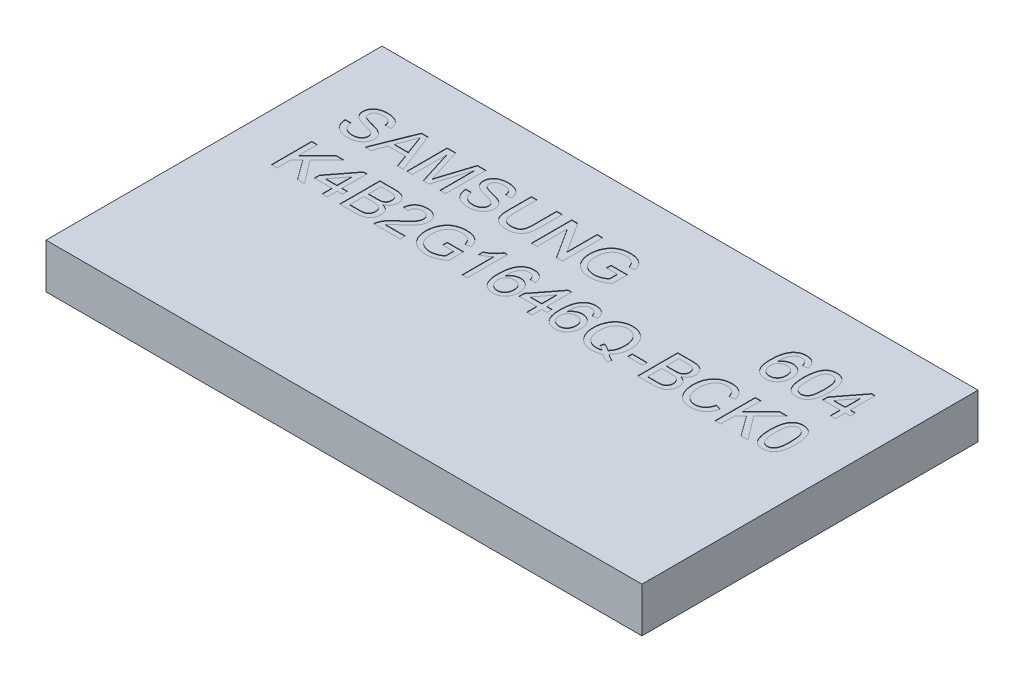
from build123d import *

# Parameters (mm, degrees)
SKETCH_1_W          = 13.3
SKETCH_1_H          = 7.5
EXTRUDE_1_DEPTH     = 1
SKETCH_2_W          = 0.334615385
SKETCH_2_H          = 0.103846154
CUT_EXTRUDE_1_DEPTH = 0.01


with BuildPart() as part:
    # Эскиз1 → Бобышка-Вытянуть1 (new body)
    with BuildSketch(Plane(origin=(0, 0, 0), x_dir=(1, 0, 0), z_dir=(0, 1, 0))):
        Rectangle(SKETCH_1_W, SKETCH_1_H)
    extrude(amount=EXTRUDE_1_DEPTH)

    # Эскиз2 → Вырез-Вытянуть1 (cut)
    # profile 1 of 25: a face of its own
    with BuildSketch(Plane(origin=(0, 1, 0), x_dir=(1, 0, 0), z_dir=(0, 1, 0))):
        with BuildLine():
            Line((-5.640073631, 1.919732649), (-5.513150555, 1.919732649))
            add(Edge.make_bspline(
                [(-5.513150555, 1.919732649), (-5.511754474, 1.908336702), (-5.509072529, 1.886444475), (-5.501573542, 1.855415537), (-5.491921862, 1.827517338), (-5.479896135, 1.802379619), (-5.464076749, 1.780303779), (-5.445017111, 1.760391709), (-5.421870217, 1.743149062), (-5.39574265, 1.727804236), (-5.366643832, 1.715756121), (-5.335578249, 1.706824654), (-5.302694057, 1.701532689), (-5.280176985, 1.700850313), (-5.268679401, 1.70050188)],
                knots=[0, 0, 0, 0, 1.125557648, 2.162256852, 3.1243583, 4.018160113, 4.88511607, 5.777380551, 6.711250965, 7.707237736, 8.743031335, 9.791730543, 10.872421559, 12, 12, 12, 12], degree=3))
            add(Edge.make_bspline(
                [(-5.268679401, 1.70050188), (-5.258505029, 1.700690197), (-5.238666974, 1.701057378), (-5.209969009, 1.705468135), (-5.182964142, 1.711724675), (-5.158154959, 1.721188671), (-5.13563298, 1.73268093), (-5.116075165, 1.746581087), (-5.099377743, 1.762256645), (-5.086302451, 1.780120491), (-5.076030762, 1.798838814), (-5.068495417, 1.818079319), (-5.064006767, 1.837735213), (-5.063434796, 1.850960712), (-5.063150555, 1.85753313)],
                knots=[0, 0, 0, 0, 1.267006637, 2.470417599, 3.611360613, 4.716023143, 5.771382139, 6.754486395, 7.697536124, 8.612899418, 9.501261124, 10.352596716, 11.181322154, 12, 12, 12, 12], degree=3))
            add(Edge.make_bspline(
                [(-5.063150555, 1.85753313), (-5.063454414, 1.864038973), (-5.064048306, 1.876754635), (-5.067918537, 1.895267049), (-5.075274457, 1.912211286), (-5.08481961, 1.928278929), (-5.098098546, 1.942969307), (-5.114874984, 1.956505181), (-5.13551855, 1.968776935), (-5.150925867, 1.975497663), (-5.159064016, 1.979047553)],
                knots=[0, 0, 0, 0, 0.942140154, 1.841411588, 2.718743672, 3.605002079, 4.535543111, 5.568170452, 6.715506882, 8, 8, 8, 8], degree=3))
            add(Edge.make_bspline(
                [(-5.159064016, 1.979047553), (-5.162234759, 1.980348722), (-5.169398045, 1.983288298), (-5.181675579, 1.98717979), (-5.196244429, 1.992211886), (-5.213454598, 1.997394127), (-5.233213955, 2.002876213), (-5.2554896, 2.009081102), (-5.280269086, 2.015679663), (-5.306849626, 2.022703112), (-5.333687871, 2.029844883), (-5.359328678, 2.036993342), (-5.38291944, 2.044249943), (-5.404653397, 2.051237049), (-5.4244185, 2.05825298), (-5.442270846, 2.065105658), (-5.458232695, 2.071656049), (-5.467981584, 2.076472451), (-5.472585651, 2.078747073)],
                knots=[0, 0, 0, 0, 0.499201778, 1.127787504, 1.87543728, 2.745208432, 3.745951656, 4.863402235, 6.114490242, 7.482339553, 8.869366102, 10.161191451, 11.360587006, 12.46547846, 13.487450326, 14.41601931, 15.251940103, 16, 16, 16, 16], degree=3))
            add(Edge.make_bspline(
                [(-5.472585651, 2.078747073), (-5.483178324, 2.08446954), (-5.503624942, 2.095515392), (-5.531143824, 2.115265405), (-5.554331276, 2.137181701), (-5.573089474, 2.161232498), (-5.58778954, 2.187011042), (-5.59770761, 2.214561155), (-5.604500669, 2.243382751), (-5.605135498, 2.263202118), (-5.605458247, 2.273278323)],
                knots=[0, 0, 0, 0, 1.158441928, 2.236094408, 3.251151369, 4.220012324, 5.163146324, 6.095083285, 7.031536583, 8, 8, 8, 8], degree=3))
            add(Edge.make_bspline(
                [(-5.605458247, 2.273278323), (-5.605029896, 2.284436017), (-5.604177908, 2.306628592), (-5.596620311, 2.339194811), (-5.5845658, 2.370532176), (-5.570844104, 2.39541137), (-5.557462419, 2.414224905), (-5.546368901, 2.427774069), (-5.53392535, 2.440298449), (-5.520514985, 2.451972878), (-5.505898083, 2.462622926), (-5.490437289, 2.472686297), (-5.473573009, 2.481336006), (-5.449876189, 2.492345132), (-5.418175552, 2.503338775), (-5.378268416, 2.51291834), (-5.336267466, 2.518559547), (-5.307638632, 2.519336084), (-5.293018343, 2.519732649)],
                knots=[0, 0, 0, 0, 1.199927478, 2.386647047, 3.578628709, 4.806592355, 5.433127754, 6.062729195, 6.689531802, 7.331674828, 7.974827539, 8.635320743, 9.315455226, 10.01318112, 11.447700238, 12.918145351, 14.426146008, 16, 16, 16, 16], degree=3))
            add(Edge.make_bspline(
                [(-5.293018343, 2.519732649), (-5.277015466, 2.519365968), (-5.24585478, 2.518651968), (-5.200577423, 2.512711622), (-5.158346044, 2.502510485), (-5.125226748, 2.491091336), (-5.100742039, 2.479530996), (-5.083347421, 2.470510581), (-5.067201775, 2.460081337), (-5.052159759, 2.448795264), (-5.038081652, 2.436657515), (-5.025329293, 2.423379375), (-5.01334894, 2.409413868), (-4.999270356, 2.389363776), (-4.984090658, 2.362827593), (-4.970965742, 2.328448913), (-4.961948772, 2.29216504), (-4.960194764, 2.267081069), (-4.959304401, 2.254348034)],
                knots=[0, 0, 0, 0, 1.607600973, 3.130308851, 4.577334065, 5.967726088, 6.640410691, 7.296826776, 7.935019992, 8.569057421, 9.185393759, 9.8003086, 10.417295362, 11.032210203, 12.259799365, 13.477607022, 14.719591916, 16, 16, 16, 16], degree=3))
            Line((-4.959304401, 2.254348034), (-5.086227478, 2.254348034))
            add(Edge.make_bspline(
                [(-5.086227478, 2.254348034), (-5.087033928, 2.260792596), (-5.088611913, 2.273402692), (-5.092526683, 2.291657705), (-5.098014404, 2.308612138), (-5.104442206, 2.324424106), (-5.112234049, 2.338929144), (-5.121317082, 2.352266534), (-5.131801919, 2.364279138), (-5.143418773, 2.375284376), (-5.156521143, 2.384866866), (-5.171041705, 2.393184761), (-5.187004971, 2.400211478), (-5.204396876, 2.405966589), (-5.223220864, 2.410428876), (-5.24351975, 2.41371142), (-5.265285688, 2.415392558), (-5.280275551, 2.41571895), (-5.287970266, 2.415886496)],
                knots=[0, 0, 0, 0, 1.074487479, 2.102453544, 3.083708351, 4.020042547, 4.923259678, 5.803182661, 6.684453325, 7.556870173, 8.445961597, 9.363679789, 10.320905216, 11.327237703, 12.390948353, 13.519046902, 14.726457512, 16, 16, 16, 16], degree=3))
            add(Edge.make_bspline(
                [(-5.287970266, 2.415886496), (-5.295968563, 2.415826208), (-5.3114513, 2.415709507), (-5.333833352, 2.413582183), (-5.354578621, 2.41066342), (-5.373651474, 2.406357996), (-5.390989433, 2.400722182), (-5.406849816, 2.394214109), (-5.420788755, 2.385966682), (-5.433131189, 2.37678012), (-5.443778102, 2.366615697), (-5.452954164, 2.355904853), (-5.461069682, 2.34496228), (-5.467375619, 2.33318985), (-5.472509599, 2.321033402), (-5.47582158, 2.308264435), (-5.47816654, 2.295119142), (-5.478410595, 2.286149846), (-5.47853517, 2.281571592)],
                knots=[0, 0, 0, 0, 1.464176581, 2.834285765, 4.113735764, 5.29917439, 6.409476712, 7.449999357, 8.431575861, 9.367089851, 10.262376129, 11.120706676, 11.948504824, 12.751342953, 13.560717798, 14.359016663, 15.162382702, 16, 16, 16, 16], degree=3))
            add(Edge.make_bspline(
                [(-5.47853517, 2.281571592), (-5.478207171, 2.273828387), (-5.477570555, 2.258799542), (-5.471069774, 2.237448082), (-5.461071529, 2.217984843), (-5.451221664, 2.207394994), (-5.446263535, 2.20206438)],
                knots=[0, 0, 0, 0, 1.050964922, 2.039826012, 3.013306874, 4, 4, 4, 4], degree=3))
            add(Edge.make_bspline(
                [(-5.446263535, 2.20206438), (-5.443137984, 2.199400394), (-5.43622602, 2.193509154), (-5.423365247, 2.185712787), (-5.407419795, 2.177835553), (-5.388283119, 2.170004971), (-5.365988146, 2.162125982), (-5.340570837, 2.154013593), (-5.311934381, 2.145956474), (-5.280951473, 2.138192107), (-5.249651511, 2.130396527), (-5.219906025, 2.122630658), (-5.192594633, 2.115270751), (-5.167760668, 2.108092367), (-5.145378426, 2.101115805), (-5.125525692, 2.094194896), (-5.108041851, 2.087829415), (-5.097330933, 2.083350779), (-5.092357285, 2.081271111)],
                knots=[0, 0, 0, 0, 0.523891492, 1.158553688, 1.913783773, 2.794766643, 3.797521443, 4.933638669, 6.202080764, 7.596537849, 9.013317056, 10.322179469, 11.523240428, 12.626146501, 13.623953177, 14.517289671, 15.311498917, 16, 16, 16, 16], degree=3))
            add(Edge.make_bspline(
                [(-5.092357285, 2.081271111), (-5.085886317, 2.078287579), (-5.073184892, 2.072431406), (-5.055191621, 2.062432872), (-5.038401948, 2.052049932), (-5.022951521, 2.041003044), (-5.008890299, 2.029268969), (-4.996061061, 2.016982155), (-4.984386323, 2.004211656), (-4.97433716, 1.990548741), (-4.965314043, 1.976545727), (-4.957418214, 1.962006903), (-4.951060645, 1.94684677), (-4.94548466, 1.93124807), (-4.941473927, 1.915037298), (-4.938328704, 1.898378195), (-4.936494148, 1.881192458), (-4.936317136, 1.869556626), (-4.936227478, 1.863662938)],
                knots=[0, 0, 0, 0, 1.198900896, 2.353241543, 3.461831299, 4.520043694, 5.547003373, 6.541368882, 7.508191797, 8.454912692, 9.392021408, 10.310662301, 11.235020644, 12.156274873, 13.095836685, 14.042125239, 15.00831306, 16, 16, 16, 16], degree=3))
            add(Edge.make_bspline(
                [(-4.936227478, 1.863662938), (-4.936697171, 1.851900738), (-4.937629667, 1.828548863), (-4.945658799, 1.794127118), (-4.958272142, 1.76077264), (-4.97306441, 1.734304024), (-4.987047574, 1.714085848), (-4.998794091, 1.699553947), (-5.011820304, 1.68611699), (-5.025805519, 1.673354023), (-5.04085832, 1.661525452), (-5.05710561, 1.650627249), (-5.074375907, 1.640545965), (-5.099037456, 1.62826133), (-5.131792091, 1.615410435), (-5.173514921, 1.604708645), (-5.217485729, 1.597766129), (-5.2476788, 1.597030976), (-5.263090458, 1.596655726)],
                knots=[0, 0, 0, 0, 1.197055466, 2.376552968, 3.581957237, 4.820753935, 5.454298064, 6.085440993, 6.72202542, 7.359198513, 8.013298489, 8.67051481, 9.351020706, 10.049282741, 11.476266879, 12.925760103, 14.430794493, 16, 16, 16, 16], degree=3))
            add(Edge.make_bspline(
                [(-5.263090458, 1.596655726), (-5.27288951, 1.596736593), (-5.292084453, 1.596894998), (-5.320289278, 1.598813338), (-5.347318478, 1.60158831), (-5.373145526, 1.605721663), (-5.397689432, 1.611144397), (-5.421038297, 1.617656053), (-5.443247466, 1.625155567), (-5.464239337, 1.633974866), (-5.483959114, 1.644221927), (-5.502761378, 1.655275914), (-5.520338793, 1.667806126), (-5.536728363, 1.68161567), (-5.552345364, 1.696305601), (-5.566542518, 1.712475843), (-5.579802492, 1.72965352), (-5.591822299, 1.747995849), (-5.602560167, 1.767262852), (-5.612216569, 1.78713096), (-5.620352223, 1.8077443), (-5.626908786, 1.828998694), (-5.632462527, 1.850751906), (-5.636313918, 1.873185429), (-5.639145591, 1.89622883), (-5.639762457, 1.911851766), (-5.640073631, 1.919732649)],
                knots=[0, 0, 0, 0, 1.259822038, 2.467811403, 3.633536148, 4.752793854, 5.829021491, 6.863980041, 7.868367876, 8.841470325, 9.788447787, 10.724101269, 11.643985084, 12.560193707, 13.478453146, 14.398077254, 15.323914234, 16.266973849, 17.21495974, 18.158525798, 19.105629373, 20.061269543, 21.017128399, 21.990322895, 22.986232211, 24, 24, 24, 24], degree=3))
        make_face()
    # profile 2 of 25: a face of its own
    with BuildSketch(Plane(origin=(0, 1, 0), x_dir=(1, 0, 0), z_dir=(0, 1, 0))):
        Polygon((-4.886287574, 1.608194188), (-4.528955843, 2.508194188), (-4.385806805, 2.508194188), (-4.028475074, 1.608194188), (-4.163150555, 1.608194188), (-4.265554401, 1.885117265), (-4.649208247, 1.885117265), (-4.751612093, 1.608194188), align=None)
        with BuildLine():
            Line((-4.610987093, 1.988963419), (-4.303775555, 1.988963419))
            Line((-4.303775555, 1.988963419), (-4.391215458, 2.22550188))
            add(Edge.make_bspline(
                [(-4.391215458, 2.22550188), (-4.394567592, 2.234641404), (-4.401121646, 2.252510899), (-4.410895716, 2.278473766), (-4.419825149, 2.30312917), (-4.42858119, 2.326123589), (-4.436485426, 2.347791038), (-4.443770962, 2.367985165), (-4.450976296, 2.386565609), (-4.455300318, 2.398570491), (-4.457381324, 2.404348034)],
                knots=[0, 0, 0, 0, 1.225184869, 2.395467751, 3.491410812, 4.525364584, 5.492066482, 6.394148129, 7.227157926, 8, 8, 8, 8], degree=3))
            add(Edge.make_bspline(
                [(-4.457381324, 2.404348034), (-4.460823708, 2.390101123), (-4.467722671, 2.361548555), (-4.48216742, 2.319715213), (-4.498691711, 2.278264456), (-4.512111405, 2.251553871), (-4.518859689, 2.238122073)],
                knots=[0, 0, 0, 0, 0.9891762, 1.982431084, 2.985436691, 4, 4, 4, 4], degree=3))
            Line((-4.518859689, 2.238122073), (-4.610987093, 1.988963419))
        make_face(mode=Mode.SUBTRACT)
    # profile 3 of 25: a face of its own
    with BuildSketch(Plane(origin=(0, 1, 0), x_dir=(1, 0, 0), z_dir=(0, 1, 0))):
        with BuildLine():
            Line((-3.955458247, 1.608194188), (-3.955458247, 2.508194188))
            Line((-3.955458247, 2.508194188), (-3.764532766, 2.508194188))
            Line((-3.764532766, 2.508194188), (-3.563330843, 1.876643707))
            add(Edge.make_bspline(
                [(-3.563330843, 1.876643707), (-3.561116607, 1.869489341), (-3.556834404, 1.855653213), (-3.550484405, 1.835672571), (-3.544706971, 1.817105043), (-3.539503481, 1.799891527), (-3.534592881, 1.784117489), (-3.530341075, 1.769653489), (-3.52627621, 1.756660256), (-3.523894017, 1.748402632), (-3.522765939, 1.744492265)],
                knots=[0, 0, 0, 0, 1.300204174, 2.514519184, 3.639827924, 4.676153899, 5.636536826, 6.507959918, 7.293450077, 8, 8, 8, 8], degree=3))
            add(Edge.make_bspline(
                [(-3.522765939, 1.744492265), (-3.521509522, 1.748760772), (-3.518835786, 1.757844428), (-3.514501232, 1.772126921), (-3.509889144, 1.787932106), (-3.504369887, 1.804988319), (-3.498616716, 1.823563117), (-3.492578014, 1.843641075), (-3.485612488, 1.865021738), (-3.480983548, 1.8798239), (-3.478595266, 1.887461015)],
                knots=[0, 0, 0, 0, 0.713638162, 1.518667645, 2.393860736, 3.354087503, 4.393659122, 5.512594909, 6.716633584, 8, 8, 8, 8], degree=3))
            Line((-3.478595266, 1.887461015), (-3.279376516, 2.508194188))
            Line((-3.279376516, 2.508194188), (-3.090073631, 2.508194188))
            Line((-3.090073631, 2.508194188), (-3.090073631, 1.608194188))
            Line((-3.090073631, 1.608194188), (-3.216996708, 1.608194188))
            Line((-3.216996708, 1.608194188), (-3.216996708, 2.369732649))
            Line((-3.216996708, 2.369732649), (-3.457140939, 1.608194188))
            Line((-3.457140939, 1.608194188), (-3.589833247, 1.608194188))
            Line((-3.589833247, 1.608194188), (-3.82853517, 2.369732649))
            Line((-3.82853517, 2.369732649), (-3.82853517, 1.608194188))
            Line((-3.82853517, 1.608194188), (-3.955458247, 1.608194188))
        make_face()
    # profile 4 of 25: a face of its own
    with BuildSketch(Plane(origin=(0, 1, 0), x_dir=(1, 0, 0), z_dir=(0, 1, 0))):
        with BuildLine():
            Line((-2.951612093, 1.919732649), (-2.824689016, 1.919732649))
            add(Edge.make_bspline(
                [(-2.824689016, 1.919732649), (-2.823292936, 1.908336702), (-2.820610991, 1.886444475), (-2.813112004, 1.855415537), (-2.803460324, 1.827517338), (-2.791434597, 1.802379619), (-2.775615211, 1.780303779), (-2.756555572, 1.760391709), (-2.733408678, 1.743149062), (-2.707281112, 1.727804236), (-2.678182294, 1.715756121), (-2.647116711, 1.706824654), (-2.614232518, 1.701532689), (-2.591715447, 1.700850313), (-2.580217862, 1.70050188)],
                knots=[0, 0, 0, 0, 1.125557648, 2.162256852, 3.1243583, 4.018160113, 4.88511607, 5.777380551, 6.711250965, 7.707237736, 8.743031335, 9.791730543, 10.872421559, 12, 12, 12, 12], degree=3))
            add(Edge.make_bspline(
                [(-2.580217862, 1.70050188), (-2.57004349, 1.700690197), (-2.550205435, 1.701057378), (-2.521507471, 1.705468135), (-2.494502603, 1.711724675), (-2.469693421, 1.721188671), (-2.447171442, 1.73268093), (-2.427613627, 1.746581087), (-2.410916204, 1.762256645), (-2.397840912, 1.780120491), (-2.387569224, 1.798838814), (-2.380033879, 1.818079319), (-2.375545228, 1.837735213), (-2.374973257, 1.850960712), (-2.374689016, 1.85753313)],
                knots=[0, 0, 0, 0, 1.267006637, 2.470417599, 3.611360613, 4.716023143, 5.771382139, 6.754486395, 7.697536124, 8.612899418, 9.501261124, 10.352596716, 11.181322154, 12, 12, 12, 12], degree=3))
            add(Edge.make_bspline(
                [(-2.374689016, 1.85753313), (-2.374992875, 1.864038973), (-2.375586767, 1.876754635), (-2.379456998, 1.895267049), (-2.386812919, 1.912211286), (-2.396358071, 1.928278929), (-2.409637008, 1.942969307), (-2.426413446, 1.956505181), (-2.447057012, 1.968776935), (-2.462464328, 1.975497663), (-2.470602478, 1.979047553)],
                knots=[0, 0, 0, 0, 0.942140154, 1.841411588, 2.718743672, 3.605002079, 4.535543111, 5.568170452, 6.715506882, 8, 8, 8, 8], degree=3))
            add(Edge.make_bspline(
                [(-2.470602478, 1.979047553), (-2.473773221, 1.980348722), (-2.480936506, 1.983288298), (-2.493214041, 1.98717979), (-2.50778289, 1.992211886), (-2.52499306, 1.997394127), (-2.544752416, 2.002876213), (-2.567028061, 2.009081102), (-2.591807548, 2.015679663), (-2.618388087, 2.022703112), (-2.645226332, 2.029844883), (-2.67086714, 2.036993342), (-2.694457902, 2.044249943), (-2.716191859, 2.051237049), (-2.735956961, 2.05825298), (-2.753809308, 2.065105658), (-2.769771156, 2.071656049), (-2.779520045, 2.076472451), (-2.784124112, 2.078747073)],
                knots=[0, 0, 0, 0, 0.499201778, 1.127787504, 1.87543728, 2.745208432, 3.745951656, 4.863402235, 6.114490242, 7.482339553, 8.869366102, 10.161191451, 11.360587006, 12.46547846, 13.487450326, 14.41601931, 15.251940103, 16, 16, 16, 16], degree=3))
            add(Edge.make_bspline(
                [(-2.784124112, 2.078747073), (-2.794716786, 2.08446954), (-2.815163403, 2.095515392), (-2.842682285, 2.115265405), (-2.865869737, 2.137181701), (-2.884627935, 2.161232498), (-2.899328001, 2.187011042), (-2.909246072, 2.214561155), (-2.916039131, 2.243382751), (-2.91667396, 2.263202118), (-2.916996708, 2.273278323)],
                knots=[0, 0, 0, 0, 1.158441928, 2.236094408, 3.251151369, 4.220012324, 5.163146324, 6.095083285, 7.031536583, 8, 8, 8, 8], degree=3))
            add(Edge.make_bspline(
                [(-2.916996708, 2.273278323), (-2.916568357, 2.284436017), (-2.915716369, 2.306628592), (-2.908158773, 2.339194811), (-2.896104261, 2.370532176), (-2.882382566, 2.39541137), (-2.869000881, 2.414224905), (-2.857907363, 2.427774069), (-2.845463812, 2.440298449), (-2.832053447, 2.451972878), (-2.817436544, 2.462622926), (-2.80197575, 2.472686297), (-2.785111471, 2.481336006), (-2.76141465, 2.492345132), (-2.729714014, 2.503338775), (-2.689806878, 2.51291834), (-2.647805928, 2.518559547), (-2.619177093, 2.519336084), (-2.604556805, 2.519732649)],
                knots=[0, 0, 0, 0, 1.199927478, 2.386647047, 3.578628709, 4.806592355, 5.433127754, 6.062729195, 6.689531802, 7.331674828, 7.974827539, 8.635320743, 9.315455226, 10.01318112, 11.447700238, 12.918145351, 14.426146008, 16, 16, 16, 16], degree=3))
            add(Edge.make_bspline(
                [(-2.604556805, 2.519732649), (-2.588553927, 2.519365968), (-2.557393242, 2.518651968), (-2.512115885, 2.512711622), (-2.469884506, 2.502510485), (-2.436765209, 2.491091336), (-2.412280501, 2.479530996), (-2.394885882, 2.470510581), (-2.378740237, 2.460081337), (-2.36369822, 2.448795264), (-2.349620113, 2.436657515), (-2.336867755, 2.423379375), (-2.324887402, 2.409413868), (-2.310808818, 2.389363776), (-2.295629119, 2.362827593), (-2.282504204, 2.328448913), (-2.273487234, 2.29216504), (-2.271733226, 2.267081069), (-2.270842862, 2.254348034)],
                knots=[0, 0, 0, 0, 1.607600973, 3.130308851, 4.577334065, 5.967726088, 6.640410691, 7.296826776, 7.935019992, 8.569057421, 9.185393759, 9.8003086, 10.417295362, 11.032210203, 12.259799365, 13.477607022, 14.719591916, 16, 16, 16, 16], degree=3))
            Line((-2.270842862, 2.254348034), (-2.397765939, 2.254348034))
            add(Edge.make_bspline(
                [(-2.397765939, 2.254348034), (-2.39857239, 2.260792596), (-2.400150374, 2.273402692), (-2.404065145, 2.291657705), (-2.409552865, 2.308612138), (-2.415980668, 2.324424106), (-2.42377251, 2.338929144), (-2.432855544, 2.352266534), (-2.44334038, 2.364279138), (-2.454957234, 2.375284376), (-2.468059604, 2.384866866), (-2.482580167, 2.393184761), (-2.498543432, 2.400211478), (-2.515935337, 2.405966589), (-2.534759325, 2.410428876), (-2.555058211, 2.41371142), (-2.57682415, 2.415392558), (-2.591814013, 2.41571895), (-2.599508728, 2.415886496)],
                knots=[0, 0, 0, 0, 1.074487479, 2.102453544, 3.083708351, 4.020042547, 4.923259678, 5.803182661, 6.684453325, 7.556870173, 8.445961597, 9.363679789, 10.320905216, 11.327237703, 12.390948353, 13.519046902, 14.726457512, 16, 16, 16, 16], degree=3))
            add(Edge.make_bspline(
                [(-2.599508728, 2.415886496), (-2.607507025, 2.415826208), (-2.622989762, 2.415709507), (-2.645371813, 2.413582183), (-2.666117082, 2.41066342), (-2.685189936, 2.406357996), (-2.702527894, 2.400722182), (-2.718388278, 2.394214109), (-2.732327216, 2.385966682), (-2.744669651, 2.37678012), (-2.755316564, 2.366615697), (-2.764492626, 2.355904853), (-2.772608144, 2.34496228), (-2.77891408, 2.33318985), (-2.784048061, 2.321033402), (-2.787360042, 2.308264435), (-2.789705002, 2.295119142), (-2.789949057, 2.286149846), (-2.790073631, 2.281571592)],
                knots=[0, 0, 0, 0, 1.464176581, 2.834285765, 4.113735764, 5.29917439, 6.409476712, 7.449999357, 8.431575861, 9.367089851, 10.262376129, 11.120706676, 11.948504824, 12.751342953, 13.560717798, 14.359016663, 15.162382702, 16, 16, 16, 16], degree=3))
            add(Edge.make_bspline(
                [(-2.790073631, 2.281571592), (-2.789745632, 2.273828387), (-2.789109016, 2.258799542), (-2.782608236, 2.237448082), (-2.77260999, 2.217984843), (-2.762760125, 2.207394994), (-2.757801997, 2.20206438)],
                knots=[0, 0, 0, 0, 1.050964922, 2.039826012, 3.013306874, 4, 4, 4, 4], degree=3))
            add(Edge.make_bspline(
                [(-2.757801997, 2.20206438), (-2.754676446, 2.199400394), (-2.747764482, 2.193509154), (-2.734903708, 2.185712787), (-2.718958256, 2.177835553), (-2.699821581, 2.170004971), (-2.677526608, 2.162125982), (-2.652109299, 2.154013593), (-2.623472843, 2.145956474), (-2.592489935, 2.138192107), (-2.561189973, 2.130396527), (-2.531444487, 2.122630658), (-2.504133095, 2.115270751), (-2.47929913, 2.108092367), (-2.456916887, 2.101115805), (-2.437064153, 2.094194896), (-2.419580313, 2.087829415), (-2.408869394, 2.083350779), (-2.403895747, 2.081271111)],
                knots=[0, 0, 0, 0, 0.523891492, 1.158553688, 1.913783773, 2.794766643, 3.797521443, 4.933638669, 6.202080764, 7.596537849, 9.013317056, 10.322179469, 11.523240428, 12.626146501, 13.623953177, 14.517289671, 15.311498917, 16, 16, 16, 16], degree=3))
            add(Edge.make_bspline(
                [(-2.403895747, 2.081271111), (-2.397424779, 2.078287579), (-2.384723353, 2.072431406), (-2.366730083, 2.062432872), (-2.349940409, 2.052049932), (-2.334489982, 2.041003044), (-2.32042876, 2.029268969), (-2.307599523, 2.016982155), (-2.295924785, 2.004211656), (-2.285875622, 1.990548741), (-2.276852504, 1.976545727), (-2.268956676, 1.962006903), (-2.262599106, 1.94684677), (-2.257023121, 1.93124807), (-2.253012389, 1.915037298), (-2.249867165, 1.898378195), (-2.248032609, 1.881192458), (-2.247855598, 1.869556626), (-2.247765939, 1.863662938)],
                knots=[0, 0, 0, 0, 1.198900896, 2.353241543, 3.461831299, 4.520043694, 5.547003373, 6.541368882, 7.508191797, 8.454912692, 9.392021408, 10.310662301, 11.235020644, 12.156274873, 13.095836685, 14.042125239, 15.00831306, 16, 16, 16, 16], degree=3))
            add(Edge.make_bspline(
                [(-2.247765939, 1.863662938), (-2.248235632, 1.851900738), (-2.249168129, 1.828548863), (-2.257197261, 1.794127118), (-2.269810603, 1.76077264), (-2.284602871, 1.734304024), (-2.298586035, 1.714085848), (-2.310332553, 1.699553947), (-2.323358765, 1.68611699), (-2.337343981, 1.673354023), (-2.352396782, 1.661525452), (-2.368644071, 1.650627249), (-2.385914368, 1.640545965), (-2.410575918, 1.62826133), (-2.443330553, 1.615410435), (-2.485053382, 1.604708645), (-2.529024191, 1.597766129), (-2.559217262, 1.597030976), (-2.57462892, 1.596655726)],
                knots=[0, 0, 0, 0, 1.197055466, 2.376552968, 3.581957237, 4.820753935, 5.454298064, 6.085440993, 6.72202542, 7.359198513, 8.013298489, 8.67051481, 9.351020706, 10.049282741, 11.476266879, 12.925760103, 14.430794493, 16, 16, 16, 16], degree=3))
            add(Edge.make_bspline(
                [(-2.57462892, 1.596655726), (-2.584427972, 1.596736593), (-2.603622915, 1.596894998), (-2.63182774, 1.598813338), (-2.658856939, 1.60158831), (-2.684683988, 1.605721663), (-2.709227894, 1.611144397), (-2.732576759, 1.617656053), (-2.754785927, 1.625155567), (-2.775777798, 1.633974866), (-2.795497575, 1.644221927), (-2.814299839, 1.655275914), (-2.831877255, 1.667806126), (-2.848266825, 1.68161567), (-2.863883826, 1.696305601), (-2.87808098, 1.712475843), (-2.891340954, 1.72965352), (-2.903360761, 1.747995849), (-2.914098628, 1.767262852), (-2.923755031, 1.78713096), (-2.931890685, 1.8077443), (-2.938447248, 1.828998694), (-2.944000989, 1.850751906), (-2.94785238, 1.873185429), (-2.950684052, 1.89622883), (-2.951300919, 1.911851766), (-2.951612093, 1.919732649)],
                knots=[0, 0, 0, 0, 1.259822038, 2.467811403, 3.633536148, 4.752793854, 5.829021491, 6.863980041, 7.868367876, 8.841470325, 9.788447787, 10.724101269, 11.643985084, 12.560193707, 13.478453146, 14.398077254, 15.323914234, 16.266973849, 17.21495974, 18.158525798, 19.105629373, 20.061269543, 21.017128399, 21.990322895, 22.986232211, 24, 24, 24, 24], degree=3))
        make_face()
    # profile 5 of 25: a face of its own
    with BuildSketch(Plane(origin=(0, 1, 0), x_dir=(1, 0, 0), z_dir=(0, 1, 0))):
        with BuildLine():
            Line((-1.509304401, 2.508194188), (-1.382381324, 2.508194188))
            Line((-1.382381324, 2.508194188), (-1.382381324, 1.990405726))
            add(Edge.make_bspline(
                [(-1.382381324, 1.990405726), (-1.382513039, 1.979407203), (-1.382769357, 1.958004058), (-1.383948529, 1.92679), (-1.386245611, 1.897310353), (-1.389762392, 1.869612794), (-1.393738125, 1.84357719), (-1.399033184, 1.819345878), (-1.405106183, 1.79682106), (-1.412093733, 1.775850553), (-1.420551514, 1.756292687), (-1.430214553, 1.737728653), (-1.441483215, 1.72010425), (-1.454328275, 1.703446228), (-1.468817886, 1.68784564), (-1.484556394, 1.672902579), (-1.501959259, 1.659027838), (-1.520835038, 1.646062589), (-1.541207171, 1.6342956), (-1.563164843, 1.624143475), (-1.586681267, 1.615773286), (-1.611650256, 1.608652478), (-1.638196461, 1.603373164), (-1.66623472, 1.599368704), (-1.695802154, 1.597013335), (-1.716030954, 1.596776695), (-1.726371708, 1.596655726)],
                knots=[0, 0, 0, 0, 1.311435591, 2.552055809, 3.723716842, 4.835547674, 5.880436826, 6.862821995, 7.791032428, 8.661143393, 9.495683908, 10.328993084, 11.1538804, 11.986573222, 12.833449924, 13.690091648, 14.571895854, 15.484149563, 16.418232274, 17.373591634, 18.364096258, 19.391643703, 20.466661433, 21.588422397, 22.767226238, 24, 24, 24, 24], degree=3))
            add(Edge.make_bspline(
                [(-1.726371708, 1.596655726), (-1.736470717, 1.596804383), (-1.756147847, 1.59709403), (-1.784982952, 1.599052619), (-1.812411472, 1.602523453), (-1.838516187, 1.607078418), (-1.863209473, 1.613251601), (-1.886454669, 1.620807631), (-1.908331136, 1.629646282), (-1.928841492, 1.639702576), (-1.947745965, 1.651313101), (-1.965378766, 1.663986443), (-1.981661055, 1.677860597), (-1.996441575, 1.693060616), (-2.009895566, 1.709357609), (-2.021835516, 1.726925749), (-2.032290017, 1.745796367), (-2.041521952, 1.765919775), (-2.049565488, 1.787592186), (-2.056051476, 1.811108961), (-2.061919352, 1.836409738), (-2.066423066, 1.863586437), (-2.070379093, 1.892604932), (-2.072673219, 1.923550985), (-2.074421114, 1.956371353), (-2.07459817, 1.978864578), (-2.074689016, 1.990405726)],
                knots=[0, 0, 0, 0, 1.192889473, 2.324252067, 3.41162405, 4.457325556, 5.452435892, 6.415456921, 7.342133401, 8.237363544, 9.110250727, 9.959377435, 10.800155199, 11.633438097, 12.46053001, 13.293359256, 14.138649731, 15.005774073, 15.906391469, 16.865847877, 17.8852706, 18.972920589, 20.118424796, 21.343408205, 22.636917643, 24, 24, 24, 24], degree=3))
            Line((-2.074689016, 1.990405726), (-2.074689016, 2.508194188))
            Line((-2.074689016, 2.508194188), (-1.947765939, 2.508194188))
            Line((-1.947765939, 2.508194188), (-1.947765939, 1.996355246))
            add(Edge.make_bspline(
                [(-1.947765939, 1.996355246), (-1.947683006, 1.987039888), (-1.947522985, 1.969065769), (-1.9466881, 1.943028239), (-1.945018476, 1.918865568), (-1.942954378, 1.896540869), (-1.940116626, 1.876134761), (-1.936482579, 1.85767713), (-1.932406386, 1.841105118), (-1.926302342, 1.821724945), (-1.916170205, 1.80009106), (-1.900202681, 1.777160911), (-1.880719128, 1.75724016), (-1.857533122, 1.740788763), (-1.831202807, 1.727716904), (-1.80190568, 1.718703695), (-1.769989312, 1.712907318), (-1.747792928, 1.712336317), (-1.736287574, 1.712040342)],
                knots=[0, 0, 0, 0, 1.090245215, 2.103644224, 3.048223674, 3.924421557, 4.727106666, 5.45815927, 6.12513286, 6.723455763, 7.834131158, 8.905266051, 9.9795367, 11.078391299, 12.21701853, 13.404826756, 14.65480846, 16, 16, 16, 16], degree=3))
            add(Edge.make_bspline(
                [(-1.736287574, 1.712040342), (-1.726426649, 1.712208214), (-1.707386202, 1.712532359), (-1.679930418, 1.715146472), (-1.654760031, 1.719912056), (-1.63166614, 1.726053338), (-1.610811262, 1.73439352), (-1.592067883, 1.744498123), (-1.575501772, 1.756421525), (-1.560994054, 1.770486752), (-1.548493744, 1.78731844), (-1.53795825, 1.807377728), (-1.528983275, 1.830682099), (-1.521628398, 1.857308485), (-1.516265662, 1.887383348), (-1.512073438, 1.920712988), (-1.509875242, 1.957443934), (-1.509500159, 1.983011427), (-1.509304401, 1.996355246)],
                knots=[0, 0, 0, 0, 1.111629428, 2.146443922, 3.104513091, 3.997025448, 4.836178689, 5.630482806, 6.392099463, 7.129930272, 7.899580577, 8.745272349, 9.676297551, 10.710246713, 11.854352966, 13.117392195, 14.495550762, 16, 16, 16, 16], degree=3))
            Line((-1.509304401, 1.996355246), (-1.509304401, 2.508194188))
        make_face()
    # profile 6 of 25: a face of its own
    with BuildSketch(Plane(origin=(0, 1, 0), x_dir=(1, 0, 0), z_dir=(0, 1, 0))):
        Polygon((-1.174689016, 1.608194188), (-1.174689016, 2.508194188), (-1.040554401, 2.508194188), (-0.609304401, 1.836619669), (-0.609304401, 2.508194188), (-0.482381324, 2.508194188), (-0.482381324, 1.608194188), (-0.616515939, 1.608194188), (-1.047765939, 2.279768707), (-1.047765939, 1.608194188), align=None)
    # profile 7 of 25: a face of its own
    with BuildSketch(Plane(origin=(0, 1, 0), x_dir=(1, 0, 0), z_dir=(0, 1, 0))):
        with BuildLine():
            Line((0.140695599, 1.965886496), (0.140695599, 2.069732649))
            Line((0.140695599, 2.069732649), (0.509926369, 2.069732649))
            Line((0.509926369, 2.069732649), (0.509926369, 1.736739861))
            add(Edge.make_bspline(
                [(0.509926369, 1.736739861), (0.495358344, 1.725644444), (0.466686665, 1.703807288), (0.421720981, 1.67532854), (0.376017784, 1.651175177), (0.32970338, 1.631234946), (0.282618581, 1.615845066), (0.234966667, 1.604829351), (0.186695746, 1.597852121), (0.154240427, 1.597054877), (0.137991272, 1.596655726)],
                knots=[0, 0, 0, 0, 1.08433114, 2.134098231, 3.14842993, 4.143565882, 5.117308249, 6.078377492, 7.037916032, 8, 8, 8, 8], degree=3))
            add(Edge.make_bspline(
                [(0.137991272, 1.596655726), (0.127107708, 1.596822799), (0.105487128, 1.597154693), (0.073476762, 1.599994069), (0.042213838, 1.604212977), (0.011757656, 1.610416654), (-0.017999306, 1.618314616), (-0.046999734, 1.628075084), (-0.075255783, 1.639464807), (-0.102609945, 1.65252262), (-0.128651072, 1.667483526), (-0.153307508, 1.683886982), (-0.176268204, 1.701980101), (-0.197568502, 1.721614892), (-0.217131386, 1.74290817), (-0.235246705, 1.76557693), (-0.251428547, 1.790036565), (-0.266034233, 1.81583716), (-0.278931107, 1.842783474), (-0.290191839, 1.870645552), (-0.2994999, 1.899356554), (-0.307262948, 1.928789466), (-0.31343654, 1.958933194), (-0.317748602, 1.989882212), (-0.320286892, 2.021612849), (-0.320656326, 2.043045408), (-0.320842862, 2.053867265)],
                knots=[0, 0, 0, 0, 1.072770755, 2.131096365, 3.165876834, 4.181397123, 5.193125461, 6.199217581, 7.195986042, 8.195005739, 9.184865672, 10.154356418, 11.112044544, 12.063776475, 13.007136321, 13.960176652, 14.921449994, 15.895149614, 16.88092309, 17.86448639, 18.855604391, 19.854360534, 20.864074582, 21.88711945, 22.933151623, 24, 24, 24, 24], degree=3))
            add(Edge.make_bspline(
                [(-0.320842862, 2.053867265), (-0.320655812, 2.064629024), (-0.320284339, 2.086001463), (-0.317724367, 2.117849595), (-0.313396505, 2.149140099), (-0.307421718, 2.179890868), (-0.299881551, 2.210075229), (-0.290488141, 2.239699024), (-0.279249721, 2.268735117), (-0.266521455, 2.297122147), (-0.252345274, 2.324453948), (-0.236065296, 2.349857042), (-0.218948966, 2.373924975), (-0.199584136, 2.395611424), (-0.179318571, 2.416036096), (-0.157160689, 2.434214458), (-0.133668994, 2.450693722), (-0.108741883, 2.465296771), (-0.082525986, 2.478040947), (-0.055334143, 2.489264815), (-0.027104639, 2.498578533), (0.002000722, 2.506436343), (0.032143218, 2.512274819), (0.063245152, 2.516666774), (0.095341669, 2.519175328), (0.117073644, 2.519545335), (0.128075407, 2.519732649)],
                knots=[0, 0, 0, 0, 1.059979929, 2.105079288, 3.144800512, 4.169876923, 5.189194625, 6.207600986, 7.228841866, 8.254191695, 9.270945245, 10.257936415, 11.22408152, 12.176290364, 13.118065146, 14.055588944, 14.994904974, 15.942096138, 16.897776019, 17.864011786, 18.837383209, 19.823806203, 20.831455606, 21.859450402, 22.916351634, 24, 24, 24, 24], degree=3))
            add(Edge.make_bspline(
                [(0.128075407, 2.519732649), (0.1439575, 2.519350555), (0.174989015, 2.518603993), (0.220421183, 2.512797613), (0.263389216, 2.502862087), (0.297441026, 2.491447234), (0.323016655, 2.480323298), (0.341094894, 2.471332914), (0.358088096, 2.46151554), (0.374191867, 2.45119021), (0.389046613, 2.439679374), (0.402847528, 2.427524296), (0.415630927, 2.414579238), (0.431369168, 2.396104153), (0.449373044, 2.370440435), (0.467437603, 2.335590588), (0.483259946, 2.296742446), (0.491090992, 2.268922268), (0.495142715, 2.254528323)],
                knots=[0, 0, 0, 0, 1.539867261, 3.008697525, 4.432261777, 5.810773619, 6.484177873, 7.135742803, 7.767512201, 8.386601754, 8.989234153, 9.587908519, 10.168964172, 10.7517707, 11.940093668, 13.199243526, 14.550910222, 16, 16, 16, 16], degree=3))
            Line((0.495142715, 2.254528323), (0.379036945, 2.225321592))
            add(Edge.make_bspline(
                [(0.379036945, 2.225321592), (0.375685841, 2.236002405), (0.36926773, 2.256458542), (0.357962934, 2.285049058), (0.344793798, 2.309736739), (0.330712747, 2.33146742), (0.313937319, 2.350161012), (0.294460386, 2.36672483), (0.271698762, 2.38110996), (0.246153668, 2.393426461), (0.218381665, 2.403483927), (0.188822992, 2.410651064), (0.157778604, 2.415108447), (0.136564312, 2.415623496), (0.125731657, 2.415886496)],
                knots=[0, 0, 0, 0, 1.164883671, 2.23101188, 3.193404931, 4.072828119, 4.918883984, 5.797350418, 6.725503451, 7.712871826, 8.743577122, 9.793233972, 10.87315899, 12, 12, 12, 12], degree=3))
            add(Edge.make_bspline(
                [(0.125731657, 2.415886496), (0.11291809, 2.415563486), (0.088109451, 2.414938101), (0.05215825, 2.410454915), (0.018889066, 2.402806943), (-0.01158659, 2.391909227), (-0.039140723, 2.378513636), (-0.064167571, 2.363366186), (-0.086242865, 2.346025027), (-0.105450516, 2.326711352), (-0.122154744, 2.306050402), (-0.137050353, 2.284514399), (-0.150004019, 2.261929592), (-0.156922783, 2.246063976), (-0.160386131, 2.238122073)],
                knots=[0, 0, 0, 0, 1.282088634, 2.482280855, 3.618640035, 4.691464057, 5.71354971, 6.679981643, 7.61357903, 8.515091979, 9.399860987, 10.268958177, 11.133486685, 12, 12, 12, 12], degree=3))
            add(Edge.make_bspline(
                [(-0.160386131, 2.238122073), (-0.165557912, 2.224153672), (-0.175967806, 2.196037711), (-0.186137247, 2.151726137), (-0.192701757, 2.105748028), (-0.193509704, 2.074443625), (-0.193919785, 2.058554765)],
                knots=[0, 0, 0, 0, 0.971932623, 1.956331326, 2.96271565, 4, 4, 4, 4], degree=3))
            add(Edge.make_bspline(
                [(-0.193919785, 2.058554765), (-0.193857638, 2.048814487), (-0.193735891, 2.029732971), (-0.191553764, 2.001715922), (-0.188700563, 1.974839513), (-0.184069969, 1.949235547), (-0.178564616, 1.924827713), (-0.171736042, 1.90160266), (-0.163389135, 1.879676311), (-0.154066153, 1.858833954), (-0.143399057, 1.839300731), (-0.131520088, 1.821097444), (-0.118473336, 1.804233803), (-0.104303291, 1.788691204), (-0.089220151, 1.774157437), (-0.072751542, 1.761187123), (-0.055082653, 1.749591881), (-0.030293918, 1.735783359), (0.002390794, 1.721843508), (0.042905759, 1.709406378), (0.084778473, 1.702019649), (0.113082963, 1.701010632), (0.127354253, 1.70050188)],
                knots=[0, 0, 0, 0, 1.070760406, 2.097653971, 3.088708526, 4.041547766, 4.95691435, 5.839291284, 6.700934147, 7.534993757, 8.348268852, 9.145600082, 9.922850605, 10.690119832, 11.456705726, 12.223547942, 12.991528328, 13.778467112, 15.341275849, 16.888285822, 18.431055468, 20, 20, 20, 20], degree=3))
            add(Edge.make_bspline(
                [(0.127354253, 1.70050188), (0.139873292, 1.700913887), (0.164853671, 1.701736001), (0.20204425, 1.707440835), (0.238650149, 1.717127839), (0.274042275, 1.730206376), (0.307149293, 1.745186751), (0.336454678, 1.761238204), (0.361902451, 1.777254924), (0.37621679, 1.789519102), (0.383003292, 1.795333611)],
                knots=[0, 0, 0, 0, 1.08078364, 2.156585965, 3.240205791, 4.344938036, 5.41078367, 6.374425311, 7.229306744, 8, 8, 8, 8], degree=3))
            Line((0.383003292, 1.795333611), (0.383003292, 1.965886496))
            Line((0.383003292, 1.965886496), (0.140695599, 1.965886496))
        make_face()
    # profile 8 of 25: a face of its own
    with BuildSketch(Plane(origin=(0, 1, 0), x_dir=(1, 0, 0), z_dir=(0, 1, 0))):
        with BuildLine():
            Line((4.329157138, 2.277424957), (4.213772522, 2.265886496))
            add(Edge.make_bspline(
                [(4.213772522, 2.265886496), (4.211282615, 2.275810188), (4.206595748, 2.294490012), (4.196767432, 2.319826375), (4.185936837, 2.341256629), (4.176527404, 2.352796229), (4.172125888, 2.358194188)],
                knots=[0, 0, 0, 0, 1.199207122, 2.257322842, 3.184815751, 4, 4, 4, 4], degree=3))
            add(Edge.make_bspline(
                [(4.172125888, 2.358194188), (4.168347698, 2.361875892), (4.160916874, 2.369116953), (4.148718164, 2.378555727), (4.135858706, 2.38655273), (4.122299631, 2.393031515), (4.108114193, 2.398149383), (4.093243632, 2.401729604), (4.077721636, 2.403945964), (4.067145334, 2.40421287), (4.061789349, 2.404348034)],
                knots=[0, 0, 0, 0, 1.028360939, 2.022547923, 3.001693811, 3.976902288, 4.948369586, 5.937776631, 6.955661634, 8, 8, 8, 8], degree=3))
            add(Edge.make_bspline(
                [(4.061789349, 2.404348034), (4.053106376, 2.404068453), (4.0359492, 2.403516013), (4.010776556, 2.39810767), (3.986326843, 2.390013221), (3.971179342, 2.381807828), (3.963532138, 2.377665342)],
                knots=[0, 0, 0, 0, 1.010336883, 1.996381556, 2.988474728, 4, 4, 4, 4], degree=3))
            add(Edge.make_bspline(
                [(3.963532138, 2.377665342), (3.956011587, 2.371434371), (3.940573695, 2.358643678), (3.920427055, 2.335009158), (3.902410181, 2.307491518), (3.889122411, 2.281801705), (3.879770901, 2.258768529), (3.873722853, 2.239028396), (3.868555548, 2.217219611), (3.864250892, 2.193383266), (3.860921517, 2.167500023), (3.858138827, 2.139553446), (3.856599763, 2.109472676), (3.856256972, 2.088724545), (3.856080215, 2.078025919)],
                knots=[0, 0, 0, 0, 1.063306303, 2.18271343, 3.369442992, 4.644240368, 5.329284104, 6.077448525, 6.892756613, 7.771869145, 8.717113863, 9.73749892, 10.833357348, 12, 12, 12, 12], degree=3))
            add(Edge.make_bspline(
                [(3.856080215, 2.078025919), (3.862882903, 2.087583492), (3.876199581, 2.106293026), (3.899691207, 2.130766484), (3.925342977, 2.151454323), (3.953183571, 2.167972176), (3.982486542, 2.180773922), (4.012605723, 2.189985929), (4.043488326, 2.195640504), (4.064289837, 2.196315598), (4.074770119, 2.196655726)],
                knots=[0, 0, 0, 0, 1.083917396, 2.121834425, 3.126226247, 4.123362703, 5.106535049, 6.077135049, 7.031216202, 8, 8, 8, 8], degree=3))
            add(Edge.make_bspline(
                [(4.074770119, 2.196655726), (4.083796209, 2.196412877), (4.101628968, 2.195933083), (4.127889725, 2.192130934), (4.15306605, 2.185480715), (4.177376123, 2.176817277), (4.20035278, 2.164988244), (4.222556786, 2.151163588), (4.243473892, 2.134340568), (4.263368826, 2.115437987), (4.281482391, 2.094422521), (4.29751418, 2.071803896), (4.310874041, 2.047527896), (4.321707343, 2.0217571), (4.330186296, 1.994585285), (4.336347262, 1.965935288), (4.339953809, 1.935750485), (4.340445023, 1.915114946), (4.340695599, 1.904588419)],
                knots=[0, 0, 0, 0, 0.981553735, 1.939246043, 2.877808487, 3.810434071, 4.740031046, 5.683044261, 6.650811044, 7.654063953, 8.664382933, 9.663624521, 10.66421212, 11.671863278, 12.699354266, 13.755775259, 14.855184124, 16, 16, 16, 16], degree=3))
            add(Edge.make_bspline(
                [(4.340695599, 1.904588419), (4.340246655, 1.8906768), (4.339360675, 1.863222555), (4.332249298, 1.822792509), (4.320790371, 1.783821852), (4.307082594, 1.752960471), (4.294488725, 1.729317355), (4.283795057, 1.71278031), (4.27236051, 1.697239655), (4.260401674, 1.682481537), (4.247051166, 1.669181409), (4.233118369, 1.656712579), (4.218142753, 1.645506125), (4.202564767, 1.635189175), (4.186090131, 1.626243326), (4.169198214, 1.618293972), (4.151749962, 1.611522586), (4.133689038, 1.606205904), (4.115107941, 1.601807305), (4.095944823, 1.598782863), (4.07625012, 1.596917612), (4.06293539, 1.596743698), (4.056200407, 1.596655726)],
                knots=[0, 0, 0, 0, 1.777979151, 3.508799182, 5.232661887, 6.960203328, 7.816385973, 8.656273476, 9.47551652, 10.283326439, 11.082130802, 11.882412381, 12.672407567, 13.471692325, 14.269609044, 15.067192643, 15.857822979, 16.66013129, 17.472860815, 18.297850482, 19.139002666, 20, 20, 20, 20], degree=3))
            add(Edge.make_bspline(
                [(4.056200407, 1.596655726), (4.044826281, 1.596971137), (4.02251962, 1.597589713), (3.989870559, 1.602341891), (3.958868847, 1.610283448), (3.92944854, 1.621386643), (3.901520013, 1.635404198), (3.875358496, 1.65297617), (3.85081923, 1.673581523), (3.827883297, 1.697339759), (3.807087307, 1.724773377), (3.789314116, 1.75644019), (3.774169781, 1.792063003), (3.76177546, 1.831739828), (3.752396537, 1.875512155), (3.745643317, 1.923285976), (3.741490162, 1.975068133), (3.740966645, 2.010950536), (3.740695599, 2.029528323)],
                knots=[0, 0, 0, 0, 0.898506621, 1.76212948, 2.600594211, 3.422599815, 4.24233914, 5.064166416, 5.906856258, 6.769969817, 7.668413694, 8.619051846, 9.63165591, 10.722000005, 11.898403521, 13.164960021, 14.532183992, 16, 16, 16, 16], degree=3))
            add(Edge.make_bspline(
                [(3.740695599, 2.029528323), (3.740740543, 2.040107113), (3.740829186, 2.060972104), (3.742253606, 2.091680169), (3.743887593, 2.12133623), (3.74668717, 2.14982197), (3.749992736, 2.17726551), (3.754428762, 2.203505462), (3.75919252, 2.228745782), (3.764984276, 2.252787747), (3.77144067, 2.275857528), (3.778872203, 2.29770164), (3.786721742, 2.318602705), (3.795626882, 2.338231011), (3.805117686, 2.356906236), (3.815608381, 2.374282788), (3.82661027, 2.390757989), (3.834732321, 2.400917115), (3.838772522, 2.40597063)],
                knots=[0, 0, 0, 0, 1.28053818, 2.525659045, 3.721026795, 4.875695215, 5.990149104, 7.066600796, 8.096771069, 9.099076143, 10.059445332, 10.995815448, 11.891625124, 12.761078582, 13.603822678, 14.426062074, 15.217066536, 16, 16, 16, 16], degree=3))
            add(Edge.make_bspline(
                [(3.838772522, 2.40597063), (3.846040772, 2.414145979), (3.860367166, 2.43026035), (3.884875122, 2.451076301), (3.910990414, 2.468856326), (3.939129549, 2.483221047), (3.969077458, 2.494420244), (4.000852916, 2.502549869), (4.03454459, 2.50726449), (4.057567731, 2.507879266), (4.069361465, 2.508194188)],
                knots=[0, 0, 0, 0, 1.005002357, 1.980952959, 2.948226316, 3.90482984, 4.879026092, 5.883055346, 6.915583142, 8, 8, 8, 8], degree=3))
            add(Edge.make_bspline(
                [(4.069361465, 2.508194188), (4.078143209, 2.508038954), (4.095395653, 2.507733984), (4.120674887, 2.504807767), (4.144719881, 2.499917033), (4.167584189, 2.493319981), (4.189134861, 2.484538462), (4.209620351, 2.474131411), (4.228832645, 2.461612383), (4.246632656, 2.447152415), (4.263064473, 2.431161409), (4.277782224, 2.413505079), (4.290730452, 2.394403485), (4.302010414, 2.373816899), (4.311521314, 2.351842771), (4.319330235, 2.328386659), (4.325265536, 2.303454591), (4.327841956, 2.286221771), (4.329157138, 2.277424957)],
                knots=[0, 0, 0, 0, 1.095988384, 2.15315746, 3.171326302, 4.156539379, 5.119213808, 6.072133135, 7.021027441, 7.975952916, 8.930907862, 9.879001051, 10.840359051, 11.807350428, 12.805278655, 13.825435679, 14.889953203, 16, 16, 16, 16], degree=3))
        make_face()
        with BuildLine():
            add(Edge.make_bspline(
                [(3.856080215, 1.906932169), (3.856401152, 1.897897606), (3.857038814, 1.879947087), (3.861916203, 1.85330262), (3.869881322, 1.827306086), (3.880797609, 1.802246198), (3.894277213, 1.778963022), (3.91028784, 1.75833252), (3.928481964, 1.740657601), (3.948761805, 1.72589991), (3.971079762, 1.714559031), (3.995036114, 1.706345287), (4.020659483, 1.701380872), (4.038329545, 1.700799303), (4.047366272, 1.70050188)],
                knots=[0, 0, 0, 0, 1.034121613, 2.054667162, 3.090870403, 4.141799978, 5.178094622, 6.163726224, 7.122467907, 8.07367165, 9.024701118, 9.977919151, 10.965878387, 12, 12, 12, 12], degree=3))
            add(Edge.make_bspline(
                [(4.047366272, 1.70050188), (4.053805968, 1.700676042), (4.066375685, 1.701015989), (4.084779791, 1.703650241), (4.102339342, 1.707700938), (4.118952664, 1.713685815), (4.134597209, 1.721324164), (4.149354209, 1.730620536), (4.163214122, 1.741602764), (4.17600937, 1.754250689), (4.187573505, 1.768317454), (4.197621205, 1.78371674), (4.206494264, 1.800195187), (4.21316822, 1.818157748), (4.218606528, 1.837144238), (4.222604723, 1.857334182), (4.224952084, 1.878750761), (4.225189618, 1.893464698), (4.225310984, 1.900982649)],
                knots=[0, 0, 0, 0, 1.023436885, 1.997658284, 2.950132304, 3.883974581, 4.798406504, 5.712938251, 6.651509614, 7.604127386, 8.56812849, 9.540661787, 10.523651728, 11.536824179, 12.580180944, 13.661349568, 14.805088061, 16, 16, 16, 16], degree=3))
            add(Edge.make_bspline(
                [(4.225310984, 1.900982649), (4.225198419, 1.908202028), (4.224978283, 1.922320435), (4.222501303, 1.94292219), (4.218892936, 1.962398153), (4.213353675, 1.980584446), (4.20655518, 1.997673602), (4.19803674, 2.013537789), (4.188111147, 2.028311837), (4.176473798, 2.041604538), (4.163747525, 2.053714969), (4.149770708, 2.064234035), (4.134711089, 2.073117957), (4.11851434, 2.080390944), (4.101149951, 2.085964833), (4.082653879, 2.089827674), (4.063130196, 2.092524106), (4.049719684, 2.092712958), (4.042859061, 2.092809573)],
                knots=[0, 0, 0, 0, 1.155658139, 2.260035327, 3.319019312, 4.323913291, 5.299809325, 6.260058621, 7.202437855, 8.144128683, 9.083751266, 10.011616631, 10.939332216, 11.87851101, 12.849505762, 13.853846437, 14.90205895, 16, 16, 16, 16], degree=3))
            add(Edge.make_bspline(
                [(4.042859061, 2.092809573), (4.036478671, 2.092709884), (4.023905507, 2.092513437), (4.005466856, 2.089795965), (3.98769574, 2.085925383), (3.970663113, 2.08029423), (3.954363114, 2.073042378), (3.93879936, 2.064221362), (3.924107006, 2.053578484), (3.910152082, 2.041659685), (3.897418382, 2.028419544), (3.886246425, 2.014095285), (3.877134109, 1.998594754), (3.869168465, 1.982297157), (3.863332316, 1.964818312), (3.859179822, 1.946392556), (3.856605382, 1.927016489), (3.856257994, 1.913731102), (3.856080215, 1.906932169)],
                knots=[0, 0, 0, 0, 1.036988316, 2.04348404, 3.025371103, 3.992992706, 4.955812186, 5.923433788, 6.897355974, 7.902569022, 8.905116476, 9.880852345, 10.849905012, 11.825004025, 12.826645469, 13.839294292, 14.894236693, 16, 16, 16, 16], degree=3))
        make_face(mode=Mode.SUBTRACT)
    # profile 9 of 25: a face of its own
    with BuildSketch(Plane(origin=(0, 1, 0), x_dir=(1, 0, 0), z_dir=(0, 1, 0))):
        with BuildLine():
            add(Edge.make_bspline(
                [(4.456080215, 2.05206438), (4.456196465, 2.064926206), (4.45642415, 2.090117107), (4.457836405, 2.126975921), (4.460302088, 2.16197921), (4.463982674, 2.195096576), (4.468341177, 2.226402771), (4.474007259, 2.255853118), (4.480382425, 2.283513694), (4.48803148, 2.309355667), (4.496435287, 2.33360123), (4.505969674, 2.356211489), (4.516697154, 2.377162471), (4.528090536, 2.39667145), (4.540749592, 2.414434981), (4.553910246, 2.430951581), (4.568528938, 2.445615522), (4.583997789, 2.458804108), (4.600544582, 2.470442267), (4.61808177, 2.480484595), (4.636541873, 2.489351246), (4.65627672, 2.496026059), (4.676876621, 2.501467446), (4.698500142, 2.505470196), (4.721171112, 2.507829953), (4.736663533, 2.508071405), (4.744541753, 2.508194188)],
                knots=[0, 0, 0, 0, 1.514747001, 2.966751498, 4.343369068, 5.64627492, 6.890416844, 8.064737671, 9.177176366, 10.232018008, 11.237056675, 12.19799043, 13.119080079, 14.007588942, 14.855863561, 15.685992447, 16.491747269, 17.290132607, 18.077525251, 18.870243746, 19.668095604, 20.485086593, 21.319398728, 22.175900658, 23.072407314, 24, 24, 24, 24], degree=3))
            add(Edge.make_bspline(
                [(4.744541753, 2.508194188), (4.756100127, 2.50785438), (4.778807016, 2.507186813), (4.811959192, 2.501742262), (4.843202981, 2.492428519), (4.872518084, 2.479863877), (4.899403364, 2.463904363), (4.923413052, 2.444503143), (4.944288166, 2.421863925), (4.961800884, 2.395718442), (4.977108749, 2.366787961), (4.990707919, 2.334942631), (5.003001174, 2.30021814), (5.011724736, 2.269134872), (5.017947245, 2.242302692), (5.022066052, 2.220172269), (5.025485487, 2.196293418), (5.028105237, 2.170723909), (5.030254679, 2.143492419), (5.031914595, 2.114581994), (5.032757173, 2.083920378), (5.032919714, 2.062882112), (5.033003292, 2.05206438)],
                knots=[0, 0, 0, 0, 1.134486744, 2.228744715, 3.287356444, 4.328707449, 5.352829806, 6.347195599, 7.349461267, 8.364207941, 9.428085653, 10.559314403, 11.761222316, 13.04268526, 13.726896727, 14.465273606, 15.252205015, 16.094778733, 16.988606776, 17.934225168, 18.937792761, 20, 20, 20, 20], degree=3))
            add(Edge.make_bspline(
                [(5.033003292, 2.05206438), (5.032884864, 2.039262968), (5.032653492, 2.014252889), (5.031279079, 1.977689621), (5.028664822, 1.942950415), (5.02544793, 1.909955693), (5.020581446, 1.878793535), (5.015337546, 1.849331543), (5.008852138, 1.821703499), (5.001285189, 1.795897294), (4.992763085, 1.771776475), (4.983417281, 1.74915875), (4.973065904, 1.728059575), (4.961400861, 1.708684738), (4.948955878, 1.690777074), (4.93563981, 1.674269404), (4.921170341, 1.659399324), (4.905562092, 1.646250296), (4.889131477, 1.634405751), (4.871551654, 1.624264275), (4.852899565, 1.615862239), (4.833299833, 1.608678915), (4.81255359, 1.603415397), (4.79082444, 1.599386256), (4.76803232, 1.597013606), (4.752479975, 1.596776665), (4.744541753, 1.596655726)],
                knots=[0, 0, 0, 0, 1.508974709, 2.94807912, 4.311757619, 5.615040294, 6.854280449, 8.028314546, 9.141715822, 10.197470207, 11.196696834, 12.155719058, 13.080757287, 13.963948316, 14.818758719, 15.649605906, 16.461113142, 17.260189315, 18.052359509, 18.845763934, 19.647754795, 20.461145776, 21.303032214, 22.167241874, 23.064524267, 24, 24, 24, 24], degree=3))
            add(Edge.make_bspline(
                [(4.744541753, 1.596655726), (4.734133824, 1.596952613), (4.713841226, 1.597531461), (4.684205383, 1.601464372), (4.656390564, 1.608386481), (4.630162166, 1.617670006), (4.605815004, 1.630087255), (4.58323283, 1.645195263), (4.561961872, 1.662642526), (4.549717015, 1.676408016), (4.543520119, 1.683374476)],
                knots=[0, 0, 0, 0, 1.10322584, 2.150986741, 3.161425019, 4.136713905, 5.093944212, 6.049774532, 7.013026876, 8, 8, 8, 8], degree=3))
            add(Edge.make_bspline(
                [(4.543520119, 1.683374476), (4.536387349, 1.693663602), (4.521679271, 1.714880219), (4.504464742, 1.751056519), (4.489109078, 1.790881546), (4.477057696, 1.835136663), (4.467618461, 1.883469648), (4.460800976, 1.935975341), (4.45694295, 1.992631059), (4.456374285, 2.031806049), (4.456080215, 2.05206438)],
                knots=[0, 0, 0, 0, 0.779365345, 1.607084704, 2.489375761, 3.438383567, 4.461919411, 5.557722155, 6.737039282, 8, 8, 8, 8], degree=3))
        make_face()
        with BuildLine():
            add(Edge.make_bspline(
                [(4.57146483, 2.052424957), (4.571579398, 2.035114684), (4.571798706, 2.001978991), (4.574089942, 1.954638938), (4.578034211, 1.911931748), (4.583248793, 1.873916552), (4.590134151, 1.840541927), (4.598779534, 1.811892922), (4.608524936, 1.787625684), (4.620584686, 1.768040987), (4.633788781, 1.752076601), (4.647421106, 1.738346714), (4.661802383, 1.726676624), (4.676838777, 1.716946148), (4.692763587, 1.709578872), (4.709402679, 1.704239053), (4.726759672, 1.70116607), (4.738580573, 1.70072454), (4.744541753, 1.70050188)],
                knots=[0, 0, 0, 0, 1.89448813, 3.626469325, 5.185477471, 6.587276848, 7.82441448, 8.910550357, 9.859733512, 10.6775885, 11.416198291, 12.123144072, 12.791880183, 13.439617036, 14.078171869, 14.70637855, 15.347637704, 16, 16, 16, 16], degree=3))
            add(Edge.make_bspline(
                [(4.744541753, 1.70050188), (4.75050144, 1.700729405), (4.762319382, 1.701180583), (4.77971648, 1.704185804), (4.796290832, 1.709800512), (4.812191899, 1.717141768), (4.827337581, 1.726650456), (4.841648228, 1.738364627), (4.855352366, 1.752086362), (4.868497148, 1.768236304), (4.88046502, 1.787911548), (4.890393234, 1.812159018), (4.898903882, 1.840858196), (4.905827022, 1.874215817), (4.911063115, 1.912170908), (4.914983536, 1.954759647), (4.917290106, 2.00203879), (4.917505795, 2.035114606), (4.917618676, 2.052424957)],
                knots=[0, 0, 0, 0, 0.652509534, 1.29391342, 1.924290653, 2.562989607, 3.207355802, 3.876242846, 4.583348185, 5.32723334, 6.150888545, 7.094226006, 8.186903555, 9.424320409, 10.81992305, 12.379283064, 14.105084285, 16, 16, 16, 16], degree=3))
            add(Edge.make_bspline(
                [(4.917618676, 2.052424957), (4.917509409, 2.069375136), (4.917300057, 2.101851038), (4.914933998, 2.148279084), (4.91122617, 2.190269452), (4.90615445, 2.227860852), (4.899414136, 2.261012473), (4.891239055, 2.289794892), (4.881497222, 2.314146725), (4.869914219, 2.334312586), (4.857020018, 2.350854064), (4.843550803, 2.365172151), (4.829169842, 2.377349219), (4.813622348, 2.387117842), (4.797409445, 2.394998803), (4.780158602, 2.400422682), (4.762039382, 2.403754943), (4.749604397, 2.404148078), (4.743279734, 2.404348034)],
                knots=[0, 0, 0, 0, 1.850066095, 3.544656626, 5.0727657, 6.45041401, 7.682899467, 8.762389858, 9.712573485, 10.538438529, 11.291566246, 11.996865408, 12.681389046, 13.341983376, 13.996294293, 14.643563182, 15.31009126, 16, 16, 16, 16], degree=3))
            add(Edge.make_bspline(
                [(4.743279734, 2.404348034), (4.737318928, 2.404191586), (4.725564984, 2.403883092), (4.708355669, 2.400938513), (4.692046604, 2.396014522), (4.676450939, 2.389344498), (4.661958012, 2.380367963), (4.647993069, 2.369887219), (4.635210173, 2.357117602), (4.627507313, 2.347571236), (4.623568195, 2.34268938)],
                knots=[0, 0, 0, 0, 1.021318143, 2.013908504, 2.982026795, 3.937174072, 4.91255697, 5.897578595, 6.924855925, 8, 8, 8, 8], degree=3))
            add(Edge.make_bspline(
                [(4.623568195, 2.34268938), (4.619279698, 2.335519446), (4.610223295, 2.320378054), (4.600089707, 2.294061691), (4.591138095, 2.263987097), (4.583767951, 2.229691553), (4.578436169, 2.19123389), (4.574226933, 2.148658768), (4.572040392, 2.101906748), (4.571661977, 2.06937396), (4.57146483, 2.052424957)],
                knots=[0, 0, 0, 0, 0.671104906, 1.417232262, 2.260109084, 3.195198885, 4.23592645, 5.382417421, 6.636286093, 8, 8, 8, 8], degree=3))
        make_face(mode=Mode.SUBTRACT)
    # profile 10 of 25: a face of its own
    with BuildSketch(Plane(origin=(0, 1, 0), x_dir=(1, 0, 0), z_dir=(0, 1, 0))):
        Polygon((5.494541753, 1.608194188), (5.494541753, 1.827424957), (5.102234061, 1.827424957), (5.102234061, 1.942809573), (5.529157138, 2.496655726), (5.609926369, 2.496655726), (5.609926369, 1.942809573), (5.725310984, 1.942809573), (5.725310984, 1.827424957), (5.609926369, 1.827424957), (5.609926369, 1.608194188), align=None)
        Polygon((5.494541753, 1.942809573), (5.494541753, 2.266968226), (5.244661945, 1.942809573), align=None, mode=Mode.SUBTRACT)
    # profile 11 of 25: a face of its own
    with BuildSketch(Plane(origin=(0, 1, 0), x_dir=(1, 0, 0), z_dir=(0, 1, 0))):
        Polygon((-5.593919785, 0.223578803), (-5.593919785, 1.123578803), (-5.466996708, 1.123578803), (-5.466996708, 0.708915342), (-5.052333247, 1.123578803), (-4.87853517, 1.123578803), (-5.254616901, 0.747497073), (-4.855458247, 0.223578803), (-5.011768343, 0.223578803), (-5.335025555, 0.66690813), (-5.466996708, 0.535117265), (-5.466996708, 0.223578803), align=None)
    # profile 12 of 25: a face of its own
    with BuildSketch(Plane(origin=(0, 1, 0), x_dir=(1, 0, 0), z_dir=(0, 1, 0))):
        Polygon((-4.463150555, 0.223578803), (-4.463150555, 0.442809573), (-4.855458247, 0.442809573), (-4.855458247, 0.558194188), (-4.42853517, 1.112040342), (-4.347765939, 1.112040342), (-4.347765939, 0.558194188), (-4.232381324, 0.558194188), (-4.232381324, 0.442809573), (-4.347765939, 0.442809573), (-4.347765939, 0.223578803), align=None)
        Polygon((-4.463150555, 0.558194188), (-4.463150555, 0.882352842), (-4.713030362, 0.558194188), align=None, mode=Mode.SUBTRACT)
    # profile 13 of 25: a face of its own
    with BuildSketch(Plane(origin=(0, 1, 0), x_dir=(1, 0, 0), z_dir=(0, 1, 0))):
        with BuildLine():
            Line((-4.070842862, 0.223578803), (-4.070842862, 1.123578803))
            Line((-4.070842862, 1.123578803), (-3.733883728, 1.123578803))
            add(Edge.make_bspline(
                [(-3.733883728, 1.123578803), (-3.725527698, 1.123546748), (-3.70922271, 1.123484198), (-3.685414055, 1.12191989), (-3.662865481, 1.119780242), (-3.641528446, 1.11702217), (-3.621495275, 1.113020263), (-3.602784637, 1.108172221), (-3.585299162, 1.102580161), (-3.563925833, 1.094061642), (-3.539295415, 1.08094983), (-3.512913898, 1.061384938), (-3.489960952, 1.037894522), (-3.471074054, 1.010961428), (-3.455513286, 0.982191806), (-3.444480884, 0.952133741), (-3.437427272, 0.921441673), (-3.436626957, 0.900659186), (-3.436227478, 0.890285534)],
                knots=[0, 0, 0, 0, 0.939712594, 1.833646414, 2.682508961, 3.487467313, 4.25240329, 4.978730417, 5.660668875, 6.315918528, 7.564895217, 8.787077865, 9.996481721, 11.241996224, 12.475862915, 13.665015424, 14.834484263, 16, 16, 16, 16], degree=3))
            add(Edge.make_bspline(
                [(-3.436227478, 0.890285534), (-3.436647415, 0.880634258), (-3.437483242, 0.861424754), (-3.444135488, 0.833127986), (-3.454634767, 0.805652), (-3.469481045, 0.779330822), (-3.488456449, 0.754645992), (-3.511980532, 0.732432703), (-3.539715254, 0.712643351), (-3.560530162, 0.702095045), (-3.571263535, 0.696655726)],
                knots=[0, 0, 0, 0, 0.926741525, 1.844548388, 2.778836836, 3.746021974, 4.738420572, 5.759761325, 6.844803049, 8, 8, 8, 8], degree=3))
            add(Edge.make_bspline(
                [(-3.571263535, 0.696655726), (-3.564623799, 0.694577204), (-3.551624326, 0.690507812), (-3.532936233, 0.683061394), (-3.515393821, 0.674582582), (-3.498958905, 0.665057442), (-3.483742534, 0.654397767), (-3.469787643, 0.642586939), (-3.456997474, 0.629807728), (-3.445394878, 0.616067906), (-3.435203215, 0.601455893), (-3.426062567, 0.58629105), (-3.418514617, 0.570390758), (-3.412327838, 0.553796299), (-3.40750123, 0.536610211), (-3.4040352, 0.518766395), (-3.402059652, 0.500306385), (-3.401762931, 0.487766124), (-3.401612093, 0.481391303)],
                knots=[0, 0, 0, 0, 1.127427615, 2.20731145, 3.257257018, 4.283066884, 5.282973838, 6.264540225, 7.242620376, 8.210460609, 9.17525685, 10.12748095, 11.077310519, 12.023587065, 12.994999128, 13.967387486, 14.966724908, 16, 16, 16, 16], degree=3))
            add(Edge.make_bspline(
                [(-3.401612093, 0.481391303), (-3.401922992, 0.471156619), (-3.402539233, 0.450870228), (-3.40748833, 0.421012073), (-3.415852043, 0.392291044), (-3.427363982, 0.365171526), (-3.441080921, 0.340095539), (-3.456670703, 0.317719654), (-3.473735756, 0.298274117), (-3.492756614, 0.281916945), (-3.513610585, 0.268034492), (-3.536886673, 0.256344559), (-3.562404911, 0.246035159), (-3.590683944, 0.237799629), (-3.6217109, 0.231257335), (-3.655906841, 0.227006796), (-3.693324305, 0.22396398), (-3.719393509, 0.223710784), (-3.732982285, 0.223578803)],
                knots=[0, 0, 0, 0, 1.028073207, 2.037766189, 3.031549473, 4.027532207, 4.992436545, 5.898794514, 6.762903869, 7.584966804, 8.412380356, 9.273953678, 10.198004568, 11.174406109, 12.229717296, 13.381036288, 14.634844708, 16, 16, 16, 16], degree=3))
            Line((-3.732982285, 0.223578803), (-4.070842862, 0.223578803))
        make_face()
        with BuildLine():
            Line((-3.943919785, 0.742809573), (-3.758402958, 0.742809573))
            add(Edge.make_bspline(
                [(-3.758402958, 0.742809573), (-3.752332386, 0.74283359), (-3.740669445, 0.742879733), (-3.72384593, 0.743523104), (-3.708318633, 0.744071992), (-3.694147614, 0.745449658), (-3.68126267, 0.74679902), (-3.669715363, 0.748615472), (-3.659449136, 0.750662201), (-3.653163123, 0.752560697), (-3.650229881, 0.753446592)],
                knots=[0, 0, 0, 0, 1.335841395, 2.566453063, 3.705076039, 4.753984432, 5.69893722, 6.555639608, 7.326018133, 8, 8, 8, 8], degree=3))
            add(Edge.make_bspline(
                [(-3.650229881, 0.753446592), (-3.643337815, 0.755860883), (-3.630051352, 0.760515132), (-3.61224625, 0.771085399), (-3.597081478, 0.783769668), (-3.584597674, 0.798791912), (-3.57500449, 0.816071737), (-3.567891421, 0.835250803), (-3.563996858, 0.856597215), (-3.563440324, 0.871400202), (-3.563150555, 0.879107649)],
                knots=[0, 0, 0, 0, 1.059015028, 2.041559358, 2.989777133, 3.920090524, 4.862499371, 5.848878527, 6.879979022, 8, 8, 8, 8], degree=3))
            add(Edge.make_bspline(
                [(-3.563150555, 0.879107649), (-3.563383549, 0.886515005), (-3.563837628, 0.900951087), (-3.567649216, 0.921914781), (-3.574245028, 0.941417649), (-3.583177564, 0.959455412), (-3.594488528, 0.975502593), (-3.607988558, 0.989299412), (-3.624160641, 0.9997292), (-3.639276694, 1.006235324), (-3.652872387, 1.010305517), (-3.66501966, 1.012713684), (-3.678798291, 1.014835518), (-3.694253622, 1.01663943), (-3.711391498, 1.018039433), (-3.730264725, 1.019151642), (-3.750828376, 1.019623859), (-3.765073521, 1.019695483), (-3.772465458, 1.019732649)],
                knots=[0, 0, 0, 0, 1.216168307, 2.37017178, 3.484610845, 4.588286376, 5.664695412, 6.69777344, 7.738183022, 8.803673002, 9.390844981, 10.0665252, 10.835811589, 11.680682236, 12.621801058, 13.660007223, 14.785756265, 16, 16, 16, 16], degree=3))
            Line((-3.772465458, 1.019732649), (-3.943919785, 1.019732649))
            Line((-3.943919785, 1.019732649), (-3.943919785, 0.742809573))
        make_face(mode=Mode.SUBTRACT)
        with BuildLine():
            Line((-3.943919785, 0.327424957), (-3.730999112, 0.327424957))
            add(Edge.make_bspline(
                [(-3.730999112, 0.327424957), (-3.722525361, 0.327522309), (-3.706956741, 0.32770117), (-3.685661911, 0.328262267), (-3.668449105, 0.329632817), (-3.658397736, 0.331108549), (-3.654015939, 0.33175188)],
                knots=[0, 0, 0, 0, 1.317581857, 2.420761387, 3.311546315, 4, 4, 4, 4], degree=3))
            add(Edge.make_bspline(
                [(-3.654015939, 0.33175188), (-3.647733744, 0.333072334), (-3.635569789, 0.335629074), (-3.618421532, 0.341335451), (-3.602698749, 0.34787241), (-3.588675855, 0.356180158), (-3.575690993, 0.365754269), (-3.564406181, 0.377712792), (-3.554012333, 0.391299698), (-3.54500698, 0.406848367), (-3.537724843, 0.424049338), (-3.532159231, 0.442636843), (-3.529194581, 0.462545711), (-3.528758075, 0.47621423), (-3.52853517, 0.483194188)],
                knots=[0, 0, 0, 0, 1.067651492, 2.067249321, 3.003744366, 3.895862395, 4.774133402, 5.679610569, 6.621910665, 7.616993802, 8.661192143, 9.724711987, 10.838102842, 12, 12, 12, 12], degree=3))
            add(Edge.make_bspline(
                [(-3.52853517, 0.483194188), (-3.528783511, 0.491389076), (-3.529267801, 0.507369945), (-3.533871148, 0.53046311), (-3.541475124, 0.551882308), (-3.552179306, 0.571330904), (-3.565308543, 0.588823241), (-3.581193595, 0.603661515), (-3.599715683, 0.615436419), (-3.620931732, 0.62467744), (-3.645729044, 0.631252267), (-3.674792223, 0.635712889), (-3.708586143, 0.638591222), (-3.732735221, 0.638834039), (-3.745602478, 0.638963419)],
                knots=[0, 0, 0, 0, 0.96167883, 1.875371887, 2.752872588, 3.621584364, 4.472914353, 5.312011319, 6.159851575, 7.038572308, 8.019870099, 9.164119506, 10.488969081, 12, 12, 12, 12], degree=3))
            Line((-3.745602478, 0.638963419), (-3.943919785, 0.638963419))
            Line((-3.943919785, 0.638963419), (-3.943919785, 0.327424957))
        make_face(mode=Mode.SUBTRACT)
    # profile 14 of 25: a face of its own
    with BuildSketch(Plane(origin=(0, 1, 0), x_dir=(1, 0, 0), z_dir=(0, 1, 0))):
        with BuildLine():
            Line((-2.720842862, 0.338963419), (-2.720842862, 0.223578803))
            Line((-2.720842862, 0.223578803), (-3.309304401, 0.223578803))
            add(Edge.make_bspline(
                [(-3.309304401, 0.223578803), (-3.309316448, 0.230436435), (-3.309340502, 0.244128714), (-3.307023548, 0.264378726), (-3.303394734, 0.284360105), (-3.299291635, 0.297173368), (-3.297225074, 0.30362688)],
                knots=[0, 0, 0, 0, 1.01057331, 2.01775941, 3.001627217, 4, 4, 4, 4], degree=3))
            add(Edge.make_bspline(
                [(-3.297225074, 0.30362688), (-3.293406756, 0.314171149), (-3.285632031, 0.335641017), (-3.269880357, 0.366619037), (-3.251352666, 0.397409709), (-3.233313352, 0.422477663), (-3.216793235, 0.442505206), (-3.202938963, 0.45817444), (-3.187585891, 0.474213748), (-3.170746313, 0.4906202), (-3.1525823, 0.507500053), (-3.133069067, 0.524909601), (-3.111976195, 0.542524399), (-3.097251162, 0.55420022), (-3.089713055, 0.560177361)],
                knots=[0, 0, 0, 0, 1.204657718, 2.452881516, 3.728232997, 5.065887527, 5.768225529, 6.518857853, 7.313994055, 8.154655305, 9.046094665, 9.979688118, 10.965752482, 12, 12, 12, 12], degree=3))
            add(Edge.make_bspline(
                [(-3.089713055, 0.560177361), (-3.078132659, 0.569924392), (-3.055833874, 0.588692918), (-3.024344494, 0.616543671), (-2.995584071, 0.642404672), (-2.970010583, 0.666729189), (-2.947414864, 0.68928129), (-2.927743859, 0.71000988), (-2.910828315, 0.728850269), (-2.896874734, 0.746484398), (-2.885101671, 0.763135922), (-2.875125039, 0.779378455), (-2.86681084, 0.795495719), (-2.859886225, 0.811436714), (-2.854409443, 0.827269612), (-2.850676237, 0.84304054), (-2.848144506, 0.858593013), (-2.847891204, 0.868941801), (-2.847765939, 0.874059573)],
                knots=[0, 0, 0, 0, 1.782554561, 3.432421876, 4.950675607, 6.337395053, 7.588547463, 8.709982106, 9.702713005, 10.569305638, 11.356701089, 12.103210377, 12.812277205, 13.490692607, 14.148717897, 14.782152033, 15.397739362, 16, 16, 16, 16], degree=3))
            add(Edge.make_bspline(
                [(-2.847765939, 0.874059573), (-2.847891219, 0.879117631), (-2.848137012, 0.889041267), (-2.85046908, 0.903564446), (-2.853715506, 0.917550615), (-2.858963988, 0.930747991), (-2.865211262, 0.943547401), (-2.873224899, 0.955544398), (-2.88249503, 0.96703798), (-2.893108545, 0.977725115), (-2.904700988, 0.987751353), (-2.917653892, 0.996085593), (-2.931116513, 1.003588892), (-2.9455533, 1.009621974), (-2.960940794, 1.014052175), (-2.977166982, 1.017267359), (-2.994229287, 1.019305958), (-3.005873112, 1.019588263), (-3.011828439, 1.019732649)],
                knots=[0, 0, 0, 0, 0.988194508, 1.938783882, 2.870742509, 3.789494954, 4.709148727, 5.651055405, 6.603531303, 7.592354411, 8.592907906, 9.593461401, 10.59787167, 11.603930315, 12.645063138, 13.723588815, 14.835711238, 16, 16, 16, 16], degree=3))
            add(Edge.make_bspline(
                [(-3.011828439, 1.019732649), (-3.018084345, 1.019588978), (-3.030327612, 1.019307802), (-3.048223991, 1.017261072), (-3.0652135, 1.014133946), (-3.081255588, 1.009352838), (-3.096330731, 1.003329816), (-3.11037753, 0.995748435), (-3.123620933, 0.987190427), (-3.135643855, 0.977058391), (-3.146516026, 0.96582403), (-3.156167982, 0.95359321), (-3.16407631, 0.9401299), (-3.170607333, 0.925730129), (-3.175858823, 0.910348629), (-3.179671225, 0.893867812), (-3.181749773, 0.876335264), (-3.182167751, 0.86432898), (-3.182381324, 0.858194188)],
                knots=[0, 0, 0, 0, 1.131143733, 2.213731411, 3.253917892, 4.251203413, 5.236093891, 6.184197493, 7.13373276, 8.082770301, 9.020476205, 9.957489029, 10.893177274, 11.836722509, 12.812818608, 13.827831385, 14.890097571, 16, 16, 16, 16], degree=3))
            Line((-3.182381324, 0.858194188), (-3.297765939, 0.869732649))
            add(Edge.make_bspline(
                [(-3.297765939, 0.869732649), (-3.296585391, 0.879788701), (-3.294288735, 0.899351883), (-3.288568079, 0.927685857), (-3.280536797, 0.954044574), (-3.270926689, 0.978795531), (-3.258879513, 1.001517392), (-3.245261218, 1.022680133), (-3.229199068, 1.041612561), (-3.211454653, 1.058911452), (-3.191833564, 1.074156327), (-3.170520111, 1.087474842), (-3.147524044, 1.098614957), (-3.122973442, 1.107838508), (-3.096811943, 1.114836648), (-3.069076557, 1.119854975), (-3.039722681, 1.122948329), (-3.0195885, 1.123365647), (-3.009304401, 1.123578803)],
                knots=[0, 0, 0, 0, 1.130804643, 2.199883102, 3.223565206, 4.205909148, 5.160801384, 6.091796021, 7.01151579, 7.927798993, 8.855738875, 9.7815393, 10.730299821, 11.705391175, 12.706931101, 13.751121791, 14.851322166, 16, 16, 16, 16], degree=3))
            add(Edge.make_bspline(
                [(-3.009304401, 1.123578803), (-2.998897206, 1.123400592), (-2.97862393, 1.123053435), (-2.949082508, 1.119501323), (-2.92120936, 1.113968942), (-2.894902304, 1.106258495), (-2.870316765, 1.096147801), (-2.847433831, 1.083794816), (-2.826147995, 1.069320039), (-2.806814898, 1.052549711), (-2.78938174, 1.034242089), (-2.774104147, 1.014703909), (-2.761331343, 0.994018639), (-2.750456094, 0.972468235), (-2.742389521, 0.949597348), (-2.736716958, 0.925716915), (-2.732862287, 0.900806528), (-2.732543776, 0.883810113), (-2.732381324, 0.875141303)],
                knots=[0, 0, 0, 0, 1.195390245, 2.328627238, 3.413424916, 4.457841177, 5.473507151, 6.462241215, 7.441013641, 8.425227782, 9.397253344, 10.342087291, 11.269524934, 12.186751184, 13.110685745, 14.048630397, 15.004728144, 16, 16, 16, 16], degree=3))
            add(Edge.make_bspline(
                [(-2.732381324, 0.875141303), (-2.732629386, 0.866235083), (-2.733126058, 0.848402988), (-2.737002647, 0.821749265), (-2.743635534, 0.795384794), (-2.752428973, 0.768988704), (-2.76444264, 0.74245623), (-2.779619868, 0.715421355), (-2.798448878, 0.687784216), (-2.816557107, 0.664289577), (-2.833412929, 0.644595145), (-2.848354022, 0.628385477), (-2.865640002, 0.611163788), (-2.884622407, 0.592333652), (-2.906075431, 0.57256339), (-2.929382678, 0.551260969), (-2.955054356, 0.528986989), (-2.972875504, 0.513770476), (-2.982080843, 0.505910534)],
                knots=[0, 0, 0, 0, 0.927118007, 1.856282007, 2.79721255, 3.754929441, 4.749232485, 5.824981375, 6.979078785, 8.228161913, 8.911614355, 9.677694854, 10.522803217, 11.452009355, 12.461436787, 13.560019032, 14.739651695, 16, 16, 16, 16], degree=3))
            add(Edge.make_bspline(
                [(-2.982080843, 0.505910534), (-2.989963826, 0.499492946), (-3.004995461, 0.487255593), (-3.026380873, 0.469514774), (-3.045535698, 0.453246924), (-3.062907869, 0.438982669), (-3.077864701, 0.426032065), (-3.090933029, 0.414962291), (-3.101638073, 0.405216765), (-3.117939959, 0.390413113), (-3.138587689, 0.369312004), (-3.15380182, 0.348808646), (-3.161107285, 0.338963419)],
                knots=[0, 0, 0, 0, 1.241996727, 2.368296581, 3.394949853, 4.3125351, 5.114548721, 5.812230366, 6.404953749, 6.883082049, 8.503329734, 10, 10, 10, 10], degree=3))
            Line((-3.161107285, 0.338963419), (-2.720842862, 0.338963419))
        make_face()
    # profile 15 of 25: a face of its own
    with BuildSketch(Plane(origin=(0, 1, 0), x_dir=(1, 0, 0), z_dir=(0, 1, 0))):
        with BuildLine():
            Line((-2.132381324, 0.581271111), (-2.132381324, 0.685117265))
            Line((-2.132381324, 0.685117265), (-1.763150555, 0.685117265))
            Line((-1.763150555, 0.685117265), (-1.763150555, 0.352124476))
            add(Edge.make_bspline(
                [(-1.763150555, 0.352124476), (-1.777718579, 0.34102906), (-1.806390259, 0.319191903), (-1.851355942, 0.290713156), (-1.897059139, 0.266559793), (-1.943373543, 0.246619562), (-1.990458342, 0.231229681), (-2.038110256, 0.220213967), (-2.086381177, 0.213236737), (-2.118836496, 0.212439492), (-2.135085651, 0.212040342)],
                knots=[0, 0, 0, 0, 1.08433114, 2.134098231, 3.14842993, 4.143565882, 5.117308249, 6.078377492, 7.037916032, 8, 8, 8, 8], degree=3))
            add(Edge.make_bspline(
                [(-2.135085651, 0.212040342), (-2.145969215, 0.212207414), (-2.167589795, 0.212539309), (-2.199600161, 0.215378684), (-2.230863085, 0.219597593), (-2.261319267, 0.22580127), (-2.291076229, 0.233699232), (-2.320076657, 0.243459699), (-2.348332706, 0.254849422), (-2.375686868, 0.267907235), (-2.401727995, 0.282868142), (-2.426384431, 0.299271597), (-2.449345127, 0.317364716), (-2.470645425, 0.336999507), (-2.490208309, 0.358292786), (-2.508323628, 0.380961546), (-2.52450547, 0.405421181), (-2.539111156, 0.431221776), (-2.55200803, 0.458168089), (-2.563268762, 0.486030167), (-2.572576823, 0.514741169), (-2.580339871, 0.544174081), (-2.586513463, 0.57431781), (-2.590825525, 0.605266828), (-2.593363815, 0.636997465), (-2.593733249, 0.658430024), (-2.593919785, 0.66925188)],
                knots=[0, 0, 0, 0, 1.072770755, 2.131096365, 3.165876834, 4.181397123, 5.193125461, 6.199217581, 7.195986042, 8.195005739, 9.184865672, 10.154356418, 11.112044544, 12.063776475, 13.007136321, 13.960176652, 14.921449994, 15.895149614, 16.88092309, 17.86448639, 18.855604391, 19.854360534, 20.864074582, 21.88711945, 22.933151623, 24, 24, 24, 24], degree=3))
            add(Edge.make_bspline(
                [(-2.593919785, 0.66925188), (-2.593732736, 0.680013639), (-2.593361262, 0.701386078), (-2.59080129, 0.73323421), (-2.586473428, 0.764524714), (-2.580498641, 0.795275483), (-2.572958474, 0.825459844), (-2.563565064, 0.85508364), (-2.552326644, 0.884119732), (-2.539598378, 0.912506762), (-2.525422197, 0.939838564), (-2.50914222, 0.965241657), (-2.492025889, 0.98930959), (-2.472661059, 1.01099604), (-2.452395494, 1.031420712), (-2.430237612, 1.049599073), (-2.406745917, 1.066078337), (-2.381818806, 1.080681387), (-2.355602909, 1.093425563), (-2.328411066, 1.10464943), (-2.300181562, 1.113963149), (-2.271076201, 1.121820958), (-2.240933706, 1.127659434), (-2.209831771, 1.132051389), (-2.177735254, 1.134559944), (-2.156003279, 1.13492995), (-2.145001516, 1.135117265)],
                knots=[0, 0, 0, 0, 1.059979929, 2.105079288, 3.144800512, 4.169876923, 5.189194625, 6.207600986, 7.228841866, 8.254191695, 9.270945245, 10.257936415, 11.22408152, 12.176290364, 13.118065146, 14.055588944, 14.994904974, 15.942096138, 16.897776019, 17.864011786, 18.837383209, 19.823806203, 20.831455606, 21.859450402, 22.916351634, 24, 24, 24, 24], degree=3))
            add(Edge.make_bspline(
                [(-2.145001516, 1.135117265), (-2.129119423, 1.13473517), (-2.098087908, 1.133988608), (-2.05265574, 1.128182228), (-2.009687707, 1.118246703), (-1.975635897, 1.10683185), (-1.950060268, 1.095707913), (-1.931982029, 1.08671753), (-1.914988827, 1.076900155), (-1.898885056, 1.066574825), (-1.88403031, 1.055063989), (-1.870229396, 1.042908911), (-1.857445996, 1.029963853), (-1.841707755, 1.011488769), (-1.823703879, 0.98582505), (-1.80563932, 0.950975204), (-1.789816977, 0.912127061), (-1.781985931, 0.884306883), (-1.777934208, 0.869912938)],
                knots=[0, 0, 0, 0, 1.539867261, 3.008697525, 4.432261777, 5.810773619, 6.484177873, 7.135742803, 7.767512201, 8.386601754, 8.989234153, 9.587908519, 10.168964172, 10.7517707, 11.940093668, 13.199243526, 14.550910222, 16, 16, 16, 16], degree=3))
            Line((-1.777934208, 0.869912938), (-1.894039978, 0.840706207))
            add(Edge.make_bspline(
                [(-1.894039978, 0.840706207), (-1.897391082, 0.85138702), (-1.903809193, 0.871843157), (-1.915113989, 0.900433673), (-1.928283125, 0.925121355), (-1.942364176, 0.946852035), (-1.959139604, 0.965545627), (-1.978616537, 0.982109446), (-2.001378161, 0.996494575), (-2.026923255, 1.008811077), (-2.054695258, 1.018868543), (-2.084253931, 1.02603568), (-2.115298319, 1.030493062), (-2.136512611, 1.031008111), (-2.147345266, 1.031271111)],
                knots=[0, 0, 0, 0, 1.164883671, 2.23101188, 3.193404931, 4.072828119, 4.918883984, 5.797350418, 6.725503451, 7.712871826, 8.743577122, 9.793233972, 10.87315899, 12, 12, 12, 12], degree=3))
            add(Edge.make_bspline(
                [(-2.147345266, 1.031271111), (-2.160158834, 1.030948102), (-2.184967472, 1.030322717), (-2.220918673, 1.02583953), (-2.254187857, 1.018191558), (-2.284663513, 1.007293843), (-2.312217646, 0.993898252), (-2.337244494, 0.978750802), (-2.359319789, 0.961409642), (-2.378527439, 0.942095967), (-2.395231667, 0.921435017), (-2.410127276, 0.899899015), (-2.423080942, 0.877314208), (-2.429999706, 0.861448592), (-2.433463055, 0.853506688)],
                knots=[0, 0, 0, 0, 1.282088634, 2.482280855, 3.618640035, 4.691464057, 5.71354971, 6.679981643, 7.61357903, 8.515091979, 9.399860987, 10.268958177, 11.133486685, 12, 12, 12, 12], degree=3))
            add(Edge.make_bspline(
                [(-2.433463055, 0.853506688), (-2.438634835, 0.839538287), (-2.449044729, 0.811422326), (-2.45921417, 0.767110752), (-2.46577868, 0.721132643), (-2.466586627, 0.689828241), (-2.466996708, 0.67393938)],
                knots=[0, 0, 0, 0, 0.971932623, 1.956331326, 2.96271565, 4, 4, 4, 4], degree=3))
            add(Edge.make_bspline(
                [(-2.466996708, 0.67393938), (-2.466934562, 0.664199102), (-2.466812814, 0.645117586), (-2.464630687, 0.617100537), (-2.461777486, 0.590224129), (-2.457146892, 0.564620163), (-2.451641539, 0.540212328), (-2.444812965, 0.516987275), (-2.436466058, 0.495060927), (-2.427143076, 0.47421857), (-2.41647598, 0.454685346), (-2.404597011, 0.436482059), (-2.391550259, 0.419618418), (-2.377380214, 0.40407582), (-2.362297074, 0.389542052), (-2.345828465, 0.376571738), (-2.328159576, 0.364976497), (-2.303370841, 0.351167974), (-2.27068613, 0.337228123), (-2.230171164, 0.324790993), (-2.18829845, 0.317404265), (-2.15999396, 0.316395248), (-2.14572267, 0.315886496)],
                knots=[0, 0, 0, 0, 1.070760406, 2.097653971, 3.088708526, 4.041547766, 4.95691435, 5.839291284, 6.700934147, 7.534993757, 8.348268852, 9.145600082, 9.922850605, 10.690119832, 11.456705726, 12.223547942, 12.991528328, 13.778467112, 15.341275849, 16.888285822, 18.431055468, 20, 20, 20, 20], degree=3))
            add(Edge.make_bspline(
                [(-2.14572267, 0.315886496), (-2.133203631, 0.316298502), (-2.108223252, 0.317120616), (-2.071032673, 0.322825451), (-2.034426774, 0.332512455), (-1.999034648, 0.345590991), (-1.96592763, 0.360571366), (-1.936622245, 0.376622819), (-1.911174472, 0.392639539), (-1.896860133, 0.404903717), (-1.890073631, 0.410718226)],
                knots=[0, 0, 0, 0, 1.08078364, 2.156585965, 3.240205791, 4.344938036, 5.41078367, 6.374425311, 7.229306744, 8, 8, 8, 8], degree=3))
            Line((-1.890073631, 0.410718226), (-1.890073631, 0.581271111))
            Line((-1.890073631, 0.581271111), (-2.132381324, 0.581271111))
        make_face()
    # profile 16 of 25: a face of its own
    with BuildSketch(Plane(origin=(0, 1, 0), x_dir=(1, 0, 0), z_dir=(0, 1, 0))):
        with BuildLine():
            Line((-1.220842862, 0.223578803), (-1.336227478, 0.223578803))
            Line((-1.336227478, 0.223578803), (-1.336227478, 0.924900919))
            add(Edge.make_bspline(
                [(-1.336227478, 0.924900919), (-1.342871334, 0.918493737), (-1.356679861, 0.905177111), (-1.380021718, 0.88633076), (-1.406074213, 0.867229185), (-1.434499039, 0.848860885), (-1.46347334, 0.831569111), (-1.491473271, 0.816017819), (-1.518031362, 0.802857653), (-1.53552532, 0.795661622), (-1.543919785, 0.792208611)],
                knots=[0, 0, 0, 0, 0.893362401, 1.856755847, 2.901947673, 4.020460078, 5.132200827, 6.168787962, 7.121294059, 8, 8, 8, 8], degree=3))
            Line((-1.543919785, 0.792208611), (-1.543919785, 0.898578803))
            add(Edge.make_bspline(
                [(-1.543919785, 0.898578803), (-1.529501425, 0.906004288), (-1.501083689, 0.920639479), (-1.460935574, 0.945916465), (-1.42345299, 0.973317758), (-1.389256422, 1.002837292), (-1.358601378, 1.033011555), (-1.332767927, 1.063458572), (-1.311152139, 1.093062286), (-1.300307088, 1.113707594), (-1.295121708, 1.123578803)],
                knots=[0, 0, 0, 0, 1.141258006, 2.249351951, 3.335817539, 4.406819942, 5.426913362, 6.360259544, 7.215985427, 8, 8, 8, 8], degree=3))
            Line((-1.295121708, 1.123578803), (-1.220842862, 1.123578803))
            Line((-1.220842862, 1.123578803), (-1.220842862, 0.223578803))
        make_face()
    # profile 17 of 25: a face of its own
    with BuildSketch(Plane(origin=(0, 1, 0), x_dir=(1, 0, 0), z_dir=(0, 1, 0))):
        with BuildLine():
            Line((-0.366996708, 0.892809573), (-0.482381324, 0.881271111))
            add(Edge.make_bspline(
                [(-0.482381324, 0.881271111), (-0.484871231, 0.891194803), (-0.489558098, 0.909874627), (-0.499386414, 0.93521099), (-0.510217009, 0.956641244), (-0.519626442, 0.968180844), (-0.524027958, 0.973578803)],
                knots=[0, 0, 0, 0, 1.199207122, 2.257322842, 3.184815751, 4, 4, 4, 4], degree=3))
            add(Edge.make_bspline(
                [(-0.524027958, 0.973578803), (-0.527806148, 0.977260508), (-0.535236973, 0.984501568), (-0.547435682, 0.993940343), (-0.56029514, 1.001937345), (-0.573854215, 1.00841613), (-0.588039653, 1.013533998), (-0.602910214, 1.01711422), (-0.61843221, 1.01933058), (-0.629008512, 1.019597485), (-0.634364497, 1.019732649)],
                knots=[0, 0, 0, 0, 1.028360939, 2.022547923, 3.001693811, 3.976902288, 4.948369586, 5.937776631, 6.955661634, 8, 8, 8, 8], degree=3))
            add(Edge.make_bspline(
                [(-0.634364497, 1.019732649), (-0.64304747, 1.019453068), (-0.660204646, 1.018900629), (-0.68537729, 1.013492285), (-0.709827003, 1.005397836), (-0.724974504, 0.997192443), (-0.732621708, 0.993049957)],
                knots=[0, 0, 0, 0, 1.010336883, 1.996381556, 2.988474728, 4, 4, 4, 4], degree=3))
            add(Edge.make_bspline(
                [(-0.732621708, 0.993049957), (-0.74014226, 0.986818986), (-0.755580152, 0.974028293), (-0.775726791, 0.950393773), (-0.793743666, 0.922876133), (-0.807031435, 0.89718632), (-0.816382945, 0.874153144), (-0.822430993, 0.854413012), (-0.827598298, 0.832604227), (-0.831902954, 0.808767881), (-0.835232329, 0.782884639), (-0.838015019, 0.754938062), (-0.839554083, 0.724857291), (-0.839896874, 0.704109161), (-0.840073631, 0.693410534)],
                knots=[0, 0, 0, 0, 1.063306303, 2.18271343, 3.369442992, 4.644240368, 5.329284104, 6.077448525, 6.892756613, 7.771869145, 8.717113863, 9.73749892, 10.833357348, 12, 12, 12, 12], degree=3))
            add(Edge.make_bspline(
                [(-0.840073631, 0.693410534), (-0.833270943, 0.702968108), (-0.819954265, 0.721677641), (-0.79646264, 0.746151099), (-0.770810869, 0.766838938), (-0.742970275, 0.783356791), (-0.713667304, 0.796158537), (-0.683548123, 0.805370545), (-0.65266552, 0.811025119), (-0.631864009, 0.811700214), (-0.621383728, 0.812040342)],
                knots=[0, 0, 0, 0, 1.083917396, 2.121834425, 3.126226247, 4.123362703, 5.106535049, 6.077135049, 7.031216202, 8, 8, 8, 8], degree=3))
            add(Edge.make_bspline(
                [(-0.621383728, 0.812040342), (-0.612357637, 0.811797493), (-0.594524878, 0.811317698), (-0.568264121, 0.80751555), (-0.543087796, 0.80086533), (-0.518777724, 0.792201892), (-0.495801066, 0.78037286), (-0.47359706, 0.766548204), (-0.452679954, 0.749725183), (-0.43278502, 0.730822602), (-0.414671456, 0.709807137), (-0.398639667, 0.687188511), (-0.385279805, 0.662912511), (-0.374446503, 0.637141716), (-0.365967551, 0.6099699), (-0.359806585, 0.581319903), (-0.356200038, 0.551135101), (-0.355708823, 0.530499561), (-0.355458247, 0.519973034)],
                knots=[0, 0, 0, 0, 0.981553735, 1.939246043, 2.877808487, 3.810434071, 4.740031046, 5.683044261, 6.650811044, 7.654063953, 8.664382933, 9.663624521, 10.66421212, 11.671863278, 12.699354266, 13.755775259, 14.855184124, 16, 16, 16, 16], degree=3))
            add(Edge.make_bspline(
                [(-0.355458247, 0.519973034), (-0.355907191, 0.506061416), (-0.356793171, 0.47860717), (-0.363904548, 0.438177124), (-0.375363475, 0.399206468), (-0.389071252, 0.368345086), (-0.401665121, 0.34470197), (-0.412358789, 0.328164926), (-0.423793336, 0.31262427), (-0.435752172, 0.297866152), (-0.44910268, 0.284566025), (-0.463035477, 0.272097194), (-0.478011093, 0.260890741), (-0.493589079, 0.25057379), (-0.510063715, 0.241627941), (-0.526955633, 0.233678588), (-0.544403884, 0.226907201), (-0.562464808, 0.221590519), (-0.581045906, 0.21719192), (-0.600209023, 0.214167478), (-0.619903726, 0.212302228), (-0.633218456, 0.212128313), (-0.639953439, 0.212040342)],
                knots=[0, 0, 0, 0, 1.777979151, 3.508799182, 5.232661887, 6.960203328, 7.816385973, 8.656273476, 9.47551652, 10.283326439, 11.082130802, 11.882412381, 12.672407567, 13.471692325, 14.269609044, 15.067192643, 15.857822979, 16.66013129, 17.472860815, 18.297850482, 19.139002666, 20, 20, 20, 20], degree=3))
            add(Edge.make_bspline(
                [(-0.639953439, 0.212040342), (-0.651327565, 0.212355752), (-0.673634226, 0.212974328), (-0.706283287, 0.217726506), (-0.737284999, 0.225668063), (-0.766705306, 0.236771258), (-0.794633833, 0.250788813), (-0.82079535, 0.268360786), (-0.845334617, 0.288966138), (-0.868270549, 0.312724375), (-0.88906654, 0.340157992), (-0.90683973, 0.371824805), (-0.921984065, 0.407447619), (-0.934378386, 0.447124443), (-0.943757309, 0.49089677), (-0.950510529, 0.538670591), (-0.954663684, 0.590452748), (-0.955187201, 0.626335152), (-0.955458247, 0.644912938)],
                knots=[0, 0, 0, 0, 0.898506621, 1.76212948, 2.600594211, 3.422599815, 4.24233914, 5.064166416, 5.906856258, 6.769969817, 7.668413694, 8.619051846, 9.63165591, 10.722000005, 11.898403521, 13.164960021, 14.532183992, 16, 16, 16, 16], degree=3))
            add(Edge.make_bspline(
                [(-0.955458247, 0.644912938), (-0.955413304, 0.655491728), (-0.95532466, 0.676356719), (-0.95390024, 0.707064785), (-0.952266254, 0.736720845), (-0.949466676, 0.765206585), (-0.94616111, 0.792650126), (-0.941725084, 0.818890077), (-0.936961327, 0.844130398), (-0.93116957, 0.868172362), (-0.924713177, 0.891242144), (-0.917281644, 0.913086255), (-0.909432104, 0.933987321), (-0.900526964, 0.953615627), (-0.89103616, 0.972290851), (-0.880545465, 0.989667404), (-0.869543576, 1.006142604), (-0.861421525, 1.01630173), (-0.857381324, 1.021355246)],
                knots=[0, 0, 0, 0, 1.28053818, 2.525659045, 3.721026795, 4.875695215, 5.990149104, 7.066600796, 8.096771069, 9.099076143, 10.059445332, 10.995815448, 11.891625124, 12.761078582, 13.603822678, 14.426062074, 15.217066536, 16, 16, 16, 16], degree=3))
            add(Edge.make_bspline(
                [(-0.857381324, 1.021355246), (-0.850113074, 1.029530594), (-0.83578668, 1.045644966), (-0.811278724, 1.066460917), (-0.785163432, 1.084240941), (-0.757024297, 1.098605662), (-0.727076388, 1.109804859), (-0.695300931, 1.117934484), (-0.661609256, 1.122649106), (-0.638586115, 1.123263881), (-0.626792381, 1.123578803)],
                knots=[0, 0, 0, 0, 1.005002357, 1.980952959, 2.948226316, 3.90482984, 4.879026092, 5.883055346, 6.915583142, 8, 8, 8, 8], degree=3))
            add(Edge.make_bspline(
                [(-0.626792381, 1.123578803), (-0.618010637, 1.123423569), (-0.600758193, 1.123118599), (-0.575478959, 1.120192382), (-0.551433965, 1.115301649), (-0.528569658, 1.108704596), (-0.507018985, 1.099923077), (-0.486533495, 1.089516026), (-0.467321202, 1.076996998), (-0.449521191, 1.062537031), (-0.433089373, 1.046546024), (-0.418371622, 1.028889695), (-0.405423394, 1.0097881), (-0.394143432, 0.989201514), (-0.384632532, 0.967227386), (-0.376823611, 0.943771274), (-0.37088831, 0.918839206), (-0.36831189, 0.901606386), (-0.366996708, 0.892809573)],
                knots=[0, 0, 0, 0, 1.095988384, 2.15315746, 3.171326302, 4.156539379, 5.119213808, 6.072133135, 7.021027441, 7.975952916, 8.930907862, 9.879001051, 10.840359051, 11.807350428, 12.805278655, 13.825435679, 14.889953203, 16, 16, 16, 16], degree=3))
        make_face()
        with BuildLine():
            add(Edge.make_bspline(
                [(-0.840073631, 0.522316784), (-0.839752694, 0.513282221), (-0.839115032, 0.495331702), (-0.834237643, 0.468687236), (-0.826272524, 0.442690701), (-0.815356237, 0.417630814), (-0.801876634, 0.394347637), (-0.785866006, 0.373717135), (-0.767671882, 0.356042216), (-0.747392041, 0.341284525), (-0.725074084, 0.329943647), (-0.701117732, 0.321729902), (-0.675494364, 0.316765488), (-0.657824301, 0.316183919), (-0.648787574, 0.315886496)],
                knots=[0, 0, 0, 0, 1.034121613, 2.054667162, 3.090870403, 4.141799978, 5.178094622, 6.163726224, 7.122467907, 8.07367165, 9.024701118, 9.977919151, 10.965878387, 12, 12, 12, 12], degree=3))
            add(Edge.make_bspline(
                [(-0.648787574, 0.315886496), (-0.642347878, 0.316060657), (-0.629778161, 0.316400605), (-0.611374055, 0.319034857), (-0.593814504, 0.323085554), (-0.577201183, 0.329070431), (-0.561556637, 0.336708779), (-0.546799637, 0.346005152), (-0.532939724, 0.35698738), (-0.520144476, 0.369635304), (-0.508580341, 0.38370207), (-0.498532641, 0.399101355), (-0.489659583, 0.415579803), (-0.482985626, 0.433542363), (-0.477547318, 0.452528854), (-0.473549123, 0.472718798), (-0.471201762, 0.494135377), (-0.470964228, 0.508849314), (-0.470842862, 0.516367265)],
                knots=[0, 0, 0, 0, 1.023436885, 1.997658284, 2.950132304, 3.883974581, 4.798406504, 5.712938251, 6.651509614, 7.604127386, 8.56812849, 9.540661787, 10.523651728, 11.536824179, 12.580180944, 13.661349568, 14.805088061, 16, 16, 16, 16], degree=3))
            add(Edge.make_bspline(
                [(-0.470842862, 0.516367265), (-0.470955427, 0.523586644), (-0.471175563, 0.53770505), (-0.473652543, 0.558306806), (-0.47726091, 0.577782768), (-0.482800171, 0.595969062), (-0.489598666, 0.613058217), (-0.498117107, 0.628922404), (-0.508042699, 0.643696452), (-0.519680048, 0.656989153), (-0.532406322, 0.669099585), (-0.546383138, 0.67961865), (-0.561442757, 0.688502572), (-0.577639506, 0.695775559), (-0.595003895, 0.701349448), (-0.613499967, 0.705212289), (-0.63302365, 0.707908721), (-0.646434162, 0.708097574), (-0.653294785, 0.708194188)],
                knots=[0, 0, 0, 0, 1.155658139, 2.260035327, 3.319019312, 4.323913291, 5.299809325, 6.260058621, 7.202437855, 8.144128683, 9.083751266, 10.011616631, 10.939332216, 11.87851101, 12.849505762, 13.853846437, 14.90205895, 16, 16, 16, 16], degree=3))
            add(Edge.make_bspline(
                [(-0.653294785, 0.708194188), (-0.659675175, 0.708094499), (-0.672248339, 0.707898052), (-0.69068699, 0.705180581), (-0.708458106, 0.701309998), (-0.725490733, 0.695678846), (-0.741790732, 0.688426994), (-0.757354486, 0.679605977), (-0.77204684, 0.668963099), (-0.786001764, 0.657044301), (-0.798735464, 0.643804159), (-0.809907421, 0.629479901), (-0.819019737, 0.61397937), (-0.826985381, 0.597681773), (-0.83282153, 0.580202927), (-0.836974024, 0.561777172), (-0.839548464, 0.542401104), (-0.839895852, 0.529115717), (-0.840073631, 0.522316784)],
                knots=[0, 0, 0, 0, 1.036988316, 2.04348404, 3.025371103, 3.992992706, 4.955812186, 5.923433788, 6.897355974, 7.902569022, 8.905116476, 9.880852345, 10.849905012, 11.825004025, 12.826645469, 13.839294292, 14.894236693, 16, 16, 16, 16], degree=3))
        make_face(mode=Mode.SUBTRACT)
    # profile 18 of 25: a face of its own
    with BuildSketch(Plane(origin=(0, 1, 0), x_dir=(1, 0, 0), z_dir=(0, 1, 0))):
        Polygon((0.106080215, 0.223578803), (0.106080215, 0.442809573), (-0.286227478, 0.442809573), (-0.286227478, 0.558194188), (0.140695599, 1.112040342), (0.22146483, 1.112040342), (0.22146483, 0.558194188), (0.336849445, 0.558194188), (0.336849445, 0.442809573), (0.22146483, 0.442809573), (0.22146483, 0.223578803), align=None)
        Polygon((0.106080215, 0.558194188), (0.106080215, 0.882352842), (-0.143799593, 0.558194188), align=None, mode=Mode.SUBTRACT)
    # profile 19 of 25: a face of its own
    with BuildSketch(Plane(origin=(0, 1, 0), x_dir=(1, 0, 0), z_dir=(0, 1, 0))):
        with BuildLine():
            Line((1.017618676, 0.892809573), (0.902234061, 0.881271111))
            add(Edge.make_bspline(
                [(0.902234061, 0.881271111), (0.899744154, 0.891194803), (0.895057287, 0.909874627), (0.88522897, 0.93521099), (0.874398375, 0.956641244), (0.864988942, 0.968180844), (0.860587426, 0.973578803)],
                knots=[0, 0, 0, 0, 1.199207122, 2.257322842, 3.184815751, 4, 4, 4, 4], degree=3))
            add(Edge.make_bspline(
                [(0.860587426, 0.973578803), (0.856809237, 0.977260508), (0.849378412, 0.984501568), (0.837179703, 0.993940343), (0.824320244, 1.001937345), (0.81076117, 1.00841613), (0.796575731, 1.013533998), (0.78170517, 1.01711422), (0.766183174, 1.01933058), (0.755606873, 1.019597485), (0.750250888, 1.019732649)],
                knots=[0, 0, 0, 0, 1.028360939, 2.022547923, 3.001693811, 3.976902288, 4.948369586, 5.937776631, 6.955661634, 8, 8, 8, 8], degree=3))
            add(Edge.make_bspline(
                [(0.750250888, 1.019732649), (0.741567914, 1.019453068), (0.724410738, 1.018900629), (0.699238095, 1.013492285), (0.674788382, 1.005397836), (0.659640881, 0.997192443), (0.651993676, 0.993049957)],
                knots=[0, 0, 0, 0, 1.010336883, 1.996381556, 2.988474728, 4, 4, 4, 4], degree=3))
            add(Edge.make_bspline(
                [(0.651993676, 0.993049957), (0.644473125, 0.986818986), (0.629035233, 0.974028293), (0.608888593, 0.950393773), (0.590871719, 0.922876133), (0.577583949, 0.89718632), (0.568232439, 0.874153144), (0.562184391, 0.854413012), (0.557017087, 0.832604227), (0.55271243, 0.808767881), (0.549383056, 0.782884639), (0.546600365, 0.754938062), (0.545061301, 0.724857291), (0.544718511, 0.704109161), (0.544541753, 0.693410534)],
                knots=[0, 0, 0, 0, 1.063306303, 2.18271343, 3.369442992, 4.644240368, 5.329284104, 6.077448525, 6.892756613, 7.771869145, 8.717113863, 9.73749892, 10.833357348, 12, 12, 12, 12], degree=3))
            add(Edge.make_bspline(
                [(0.544541753, 0.693410534), (0.551344442, 0.702968108), (0.564661119, 0.721677641), (0.588152745, 0.746151099), (0.613804515, 0.766838938), (0.64164511, 0.783356791), (0.670948081, 0.796158537), (0.701067261, 0.805370545), (0.731949864, 0.811025119), (0.752751375, 0.811700214), (0.763231657, 0.812040342)],
                knots=[0, 0, 0, 0, 1.083917396, 2.121834425, 3.126226247, 4.123362703, 5.106535049, 6.077135049, 7.031216202, 8, 8, 8, 8], degree=3))
            add(Edge.make_bspline(
                [(0.763231657, 0.812040342), (0.772257748, 0.811797493), (0.790090507, 0.811317698), (0.816351264, 0.80751555), (0.841527589, 0.80086533), (0.865837661, 0.792201892), (0.888814319, 0.78037286), (0.911018324, 0.766548204), (0.93193543, 0.749725183), (0.951830365, 0.730822602), (0.969943929, 0.709807137), (0.985975718, 0.687188511), (0.999335579, 0.662912511), (1.010168882, 0.637141716), (1.018647834, 0.6099699), (1.0248088, 0.581319903), (1.028415347, 0.551135101), (1.028906561, 0.530499561), (1.029157138, 0.519973034)],
                knots=[0, 0, 0, 0, 0.981553735, 1.939246043, 2.877808487, 3.810434071, 4.740031046, 5.683044261, 6.650811044, 7.654063953, 8.664382933, 9.663624521, 10.66421212, 11.671863278, 12.699354266, 13.755775259, 14.855184124, 16, 16, 16, 16], degree=3))
            add(Edge.make_bspline(
                [(1.029157138, 0.519973034), (1.028708194, 0.506061416), (1.027822214, 0.47860717), (1.020710836, 0.438177124), (1.00925191, 0.399206468), (0.995544133, 0.368345086), (0.982950264, 0.34470197), (0.972256596, 0.328164926), (0.960822048, 0.31262427), (0.948863212, 0.297866152), (0.935512704, 0.284566025), (0.921579908, 0.272097194), (0.906604292, 0.260890741), (0.891026306, 0.25057379), (0.87455167, 0.241627941), (0.857659752, 0.233678588), (0.840211501, 0.226907201), (0.822150577, 0.221590519), (0.803569479, 0.21719192), (0.784406362, 0.214167478), (0.764711659, 0.212302228), (0.751396928, 0.212128313), (0.744661945, 0.212040342)],
                knots=[0, 0, 0, 0, 1.777979151, 3.508799182, 5.232661887, 6.960203328, 7.816385973, 8.656273476, 9.47551652, 10.283326439, 11.082130802, 11.882412381, 12.672407567, 13.471692325, 14.269609044, 15.067192643, 15.857822979, 16.66013129, 17.472860815, 18.297850482, 19.139002666, 20, 20, 20, 20], degree=3))
            add(Edge.make_bspline(
                [(0.744661945, 0.212040342), (0.73328782, 0.212355752), (0.710981159, 0.212974328), (0.678332097, 0.217726506), (0.647330386, 0.225668063), (0.617910078, 0.236771258), (0.589981551, 0.250788813), (0.563820034, 0.268360786), (0.539280768, 0.288966138), (0.516344835, 0.312724375), (0.495548845, 0.340157992), (0.477775655, 0.371824805), (0.462631319, 0.407447619), (0.450236999, 0.447124443), (0.440858076, 0.49089677), (0.434104856, 0.538670591), (0.429951701, 0.590452748), (0.429428184, 0.626335152), (0.429157138, 0.644912938)],
                knots=[0, 0, 0, 0, 0.898506621, 1.76212948, 2.600594211, 3.422599815, 4.24233914, 5.064166416, 5.906856258, 6.769969817, 7.668413694, 8.619051846, 9.63165591, 10.722000005, 11.898403521, 13.164960021, 14.532183992, 16, 16, 16, 16], degree=3))
            add(Edge.make_bspline(
                [(0.429157138, 0.644912938), (0.429202081, 0.655491728), (0.429290724, 0.676356719), (0.430715145, 0.707064785), (0.432349131, 0.736720845), (0.435148708, 0.765206585), (0.438454275, 0.792650126), (0.442890301, 0.818890077), (0.447654058, 0.844130398), (0.453445815, 0.868172362), (0.459902208, 0.891242144), (0.467333741, 0.913086255), (0.475183281, 0.933987321), (0.484088421, 0.953615627), (0.493579225, 0.972290851), (0.50406992, 0.989667404), (0.515071808, 1.006142604), (0.52319386, 1.01630173), (0.527234061, 1.021355246)],
                knots=[0, 0, 0, 0, 1.28053818, 2.525659045, 3.721026795, 4.875695215, 5.990149104, 7.066600796, 8.096771069, 9.099076143, 10.059445332, 10.995815448, 11.891625124, 12.761078582, 13.603822678, 14.426062074, 15.217066536, 16, 16, 16, 16], degree=3))
            add(Edge.make_bspline(
                [(0.527234061, 1.021355246), (0.53450231, 1.029530594), (0.548828704, 1.045644966), (0.573336661, 1.066460917), (0.599451953, 1.084240941), (0.627591088, 1.098605662), (0.657538997, 1.109804859), (0.689314454, 1.117934484), (0.723006128, 1.122649106), (0.746029269, 1.123263881), (0.757823003, 1.123578803)],
                knots=[0, 0, 0, 0, 1.005002357, 1.980952959, 2.948226316, 3.90482984, 4.879026092, 5.883055346, 6.915583142, 8, 8, 8, 8], degree=3))
            add(Edge.make_bspline(
                [(0.757823003, 1.123578803), (0.766604747, 1.123423569), (0.783857192, 1.123118599), (0.809136425, 1.120192382), (0.833181419, 1.115301649), (0.856045727, 1.108704596), (0.877596399, 1.099923077), (0.898081889, 1.089516026), (0.917294183, 1.076996998), (0.935094194, 1.062537031), (0.951526012, 1.046546024), (0.966243763, 1.028889695), (0.979191991, 1.0097881), (0.990471953, 0.989201514), (0.999982852, 0.967227386), (1.007791774, 0.943771274), (1.013727075, 0.918839206), (1.016303495, 0.901606386), (1.017618676, 0.892809573)],
                knots=[0, 0, 0, 0, 1.095988384, 2.15315746, 3.171326302, 4.156539379, 5.119213808, 6.072133135, 7.021027441, 7.975952916, 8.930907862, 9.879001051, 10.840359051, 11.807350428, 12.805278655, 13.825435679, 14.889953203, 16, 16, 16, 16], degree=3))
        make_face()
        with BuildLine():
            add(Edge.make_bspline(
                [(0.544541753, 0.522316784), (0.544862691, 0.513282221), (0.545500353, 0.495331702), (0.550377741, 0.468687236), (0.558342861, 0.442690701), (0.569259147, 0.417630814), (0.582738751, 0.394347637), (0.598749378, 0.373717135), (0.616943502, 0.356042216), (0.637223344, 0.341284525), (0.659541301, 0.329943647), (0.683497652, 0.321729902), (0.709121021, 0.316765488), (0.726791083, 0.316183919), (0.735827811, 0.315886496)],
                knots=[0, 0, 0, 0, 1.034121613, 2.054667162, 3.090870403, 4.141799978, 5.178094622, 6.163726224, 7.122467907, 8.07367165, 9.024701118, 9.977919151, 10.965878387, 12, 12, 12, 12], degree=3))
            add(Edge.make_bspline(
                [(0.735827811, 0.315886496), (0.742267507, 0.316060657), (0.754837223, 0.316400605), (0.77324133, 0.319034857), (0.790800881, 0.323085554), (0.807414202, 0.329070431), (0.823058747, 0.336708779), (0.837815748, 0.346005152), (0.851675661, 0.35698738), (0.864470908, 0.369635304), (0.876035044, 0.38370207), (0.886082744, 0.399101355), (0.894955802, 0.415579803), (0.901629758, 0.433542363), (0.907068066, 0.452528854), (0.911066261, 0.472718798), (0.913413622, 0.494135377), (0.913651156, 0.508849314), (0.913772522, 0.516367265)],
                knots=[0, 0, 0, 0, 1.023436885, 1.997658284, 2.950132304, 3.883974581, 4.798406504, 5.712938251, 6.651509614, 7.604127386, 8.56812849, 9.540661787, 10.523651728, 11.536824179, 12.580180944, 13.661349568, 14.805088061, 16, 16, 16, 16], degree=3))
            add(Edge.make_bspline(
                [(0.913772522, 0.516367265), (0.913659957, 0.523586644), (0.913439822, 0.53770505), (0.910962841, 0.558306806), (0.907354475, 0.577782768), (0.901815213, 0.595969062), (0.895016718, 0.613058217), (0.886498278, 0.628922404), (0.876572685, 0.643696452), (0.864935336, 0.656989153), (0.852209063, 0.669099585), (0.838232247, 0.67961865), (0.823172628, 0.688502572), (0.806975879, 0.695775559), (0.78961149, 0.701349448), (0.771115417, 0.705212289), (0.751591734, 0.707908721), (0.738181223, 0.708097574), (0.731320599, 0.708194188)],
                knots=[0, 0, 0, 0, 1.155658139, 2.260035327, 3.319019312, 4.323913291, 5.299809325, 6.260058621, 7.202437855, 8.144128683, 9.083751266, 10.011616631, 10.939332216, 11.87851101, 12.849505762, 13.853846437, 14.90205895, 16, 16, 16, 16], degree=3))
            add(Edge.make_bspline(
                [(0.731320599, 0.708194188), (0.72494021, 0.708094499), (0.712367046, 0.707898052), (0.693928395, 0.705180581), (0.676157278, 0.701309998), (0.659124651, 0.695678846), (0.642824653, 0.688426994), (0.627260899, 0.679605977), (0.612568544, 0.668963099), (0.598613621, 0.657044301), (0.585879921, 0.643804159), (0.574707963, 0.629479901), (0.565595647, 0.61397937), (0.557630004, 0.597681773), (0.551793854, 0.580202927), (0.54764136, 0.561777172), (0.54506692, 0.542401104), (0.544719532, 0.529115717), (0.544541753, 0.522316784)],
                knots=[0, 0, 0, 0, 1.036988316, 2.04348404, 3.025371103, 3.992992706, 4.955812186, 5.923433788, 6.897355974, 7.902569022, 8.905116476, 9.880852345, 10.849905012, 11.825004025, 12.826645469, 13.839294292, 14.894236693, 16, 16, 16, 16], degree=3))
        make_face(mode=Mode.SUBTRACT)
    # profile 20 of 25: a face of its own
    with BuildSketch(Plane(origin=(0, 1, 0), x_dir=(1, 0, 0), z_dir=(0, 1, 0))):
        with BuildLine():
            add(Edge.make_bspline(
                [(1.83630858, 0.325622073), (1.850566555, 0.316314722), (1.878055311, 0.298370556), (1.919577514, 0.275163656), (1.959135349, 0.255302572), (1.985625354, 0.244965382), (1.998387907, 0.239985053)],
                knots=[0, 0, 0, 0, 1.111827843, 2.143555646, 3.105588288, 4, 4, 4, 4], degree=3))
            Line((1.998387907, 0.239985053), (1.956921561, 0.157773515))
            add(Edge.make_bspline(
                [(1.956921561, 0.157773515), (1.940827811, 0.163578603), (1.908085789, 0.175388798), (1.860116033, 0.198451848), (1.812086831, 0.225845446), (1.781225239, 0.247254391), (1.765455215, 0.258194188)],
                knots=[0, 0, 0, 0, 0.94560062, 1.92378273, 2.939069792, 4, 4, 4, 4], degree=3))
            add(Edge.make_bspline(
                [(1.765455215, 0.258194188), (1.757446594, 0.254484925), (1.741393765, 0.247049916), (1.716428848, 0.237736728), (1.690894314, 0.229843439), (1.664727878, 0.223262927), (1.637985575, 0.218287722), (1.610606948, 0.214663812), (1.582619597, 0.212444811), (1.563716476, 0.212176186), (1.554157138, 0.212040342)],
                knots=[0, 0, 0, 0, 0.970848578, 1.94601126, 2.929033963, 3.910543158, 4.913055355, 5.920267058, 6.948275668, 8, 8, 8, 8], degree=3))
            add(Edge.make_bspline(
                [(1.554157138, 0.212040342), (1.54453625, 0.212214849), (1.52549633, 0.212560203), (1.497225437, 0.215279954), (1.469681956, 0.220069424), (1.442685025, 0.226238371), (1.416559561, 0.234692002), (1.390979191, 0.244505152), (1.366239658, 0.256560995), (1.34216645, 0.270157414), (1.319135148, 0.285441919), (1.297367922, 0.302296807), (1.276995692, 0.32067797), (1.25802832, 0.340626375), (1.240294913, 0.361889163), (1.224084401, 0.384740895), (1.209003026, 0.408929451), (1.195633246, 0.434683927), (1.183523428, 0.461503126), (1.173064367, 0.489329736), (1.164248328, 0.517996922), (1.15704087, 0.547435027), (1.151391829, 0.577707211), (1.147574302, 0.608841759), (1.144843882, 0.640778051), (1.144643114, 0.662334874), (1.144541753, 0.673218226)],
                knots=[0, 0, 0, 0, 1.001343364, 1.981677464, 2.952465493, 3.909880336, 4.861453418, 5.808182493, 6.759426552, 7.72307418, 8.684221331, 9.633900979, 10.586131764, 11.537375823, 12.49687276, 13.46546158, 14.451447215, 15.461525227, 16.48346517, 17.512844437, 18.553602584, 19.603475668, 20.665963575, 21.756852965, 22.86750658, 24, 24, 24, 24], degree=3))
            add(Edge.make_bspline(
                [(1.144541753, 0.673218226), (1.144746907, 0.68409867), (1.145153145, 0.705643698), (1.147424269, 0.737622599), (1.151705343, 0.768822145), (1.157125677, 0.799333765), (1.164646404, 0.829036621), (1.173642728, 0.857972202), (1.1840579, 0.886278691), (1.196359895, 0.913552421), (1.209916374, 0.939836769), (1.225058812, 0.964530593), (1.241583969, 0.987591989), (1.259412495, 1.00910729), (1.278761846, 1.028935554), (1.29937731, 1.047260559), (1.321446238, 1.063897434), (1.344898474, 1.078787375), (1.369265455, 1.092102104), (1.394550771, 1.103522676), (1.420477321, 1.113177459), (1.447079681, 1.121471229), (1.474481914, 1.127497585), (1.502550477, 1.131781931), (1.531262518, 1.134623705), (1.550664792, 1.134951604), (1.560467234, 1.135117265)],
                knots=[0, 0, 0, 0, 1.121473414, 2.220697547, 3.301622286, 4.36580856, 5.412823992, 6.456977718, 7.487802023, 8.519147191, 9.538595708, 10.533920749, 11.501593819, 12.460345851, 13.410799626, 14.354123176, 15.30051201, 16.25579679, 17.214748857, 18.159961473, 19.112491556, 20.064659116, 21.029354418, 22.000805968, 22.989964595, 24, 24, 24, 24], degree=3))
            add(Edge.make_bspline(
                [(1.560467234, 1.135117265), (1.57038866, 1.134944762), (1.589968616, 1.134604327), (1.619016434, 1.131871842), (1.647229932, 1.127119031), (1.674861674, 1.120869555), (1.701660681, 1.112557808), (1.727737747, 1.102416568), (1.753036148, 1.090482805), (1.777498468, 1.076815904), (1.800882318, 1.061530848), (1.82301859, 1.044750824), (1.843490925, 1.026282377), (1.862812135, 1.006606102), (1.880348732, 0.985202515), (1.896962171, 0.962696995), (1.911671819, 0.938413922), (1.924956734, 0.912842004), (1.936866704, 0.886189835), (1.947131212, 0.858599191), (1.955754642, 0.830159032), (1.963084908, 0.800954501), (1.968374526, 0.770746208), (1.972300735, 0.739762709), (1.975008164, 0.707941429), (1.975209203, 0.686445061), (1.975310984, 0.675561976)],
                knots=[0, 0, 0, 0, 1.026932736, 2.026653956, 3.016650029, 3.986983192, 4.957077022, 5.918253531, 6.881119632, 7.85031544, 8.81657189, 9.770899289, 10.72252611, 11.66838093, 12.622606941, 13.584467691, 14.561775396, 15.557909377, 16.56601516, 17.581731705, 18.603052797, 19.641117819, 20.696651352, 21.775377028, 22.873727849, 24, 24, 24, 24], degree=3))
            add(Edge.make_bspline(
                [(1.975310984, 0.675561976), (1.974918282, 0.657692492), (1.974151304, 0.622791904), (1.967499917, 0.571850233), (1.956781431, 0.523641082), (1.944020304, 0.485511797), (1.931779273, 0.456517367), (1.921363097, 0.435696823), (1.910158657, 0.415451912), (1.897323439, 0.396215465), (1.883921518, 0.377310652), (1.869033984, 0.359417872), (1.853401312, 0.341901265), (1.842034782, 0.331075732), (1.83630858, 0.325622073)],
                knots=[0, 0, 0, 0, 1.657762372, 3.237747825, 4.758539186, 6.234712655, 6.961904268, 7.67773635, 8.394415249, 9.107526395, 9.822641155, 10.543884314, 11.266441626, 12, 12, 12, 12], degree=3))
        make_face()
        with BuildLine():
            add(Edge.make_bspline(
                [(1.590395119, 0.475982649), (1.59829442, 0.47353768), (1.613915726, 0.468702618), (1.636508801, 0.460197425), (1.658181037, 0.451025148), (1.678592505, 0.440744673), (1.698108261, 0.42972901), (1.71637667, 0.417611294), (1.733840791, 0.404886735), (1.744604832, 0.395532127), (1.749950407, 0.390886496)],
                knots=[0, 0, 0, 0, 1.088167186, 2.151910732, 3.176006567, 4.184185317, 5.158435446, 6.123749827, 7.068227632, 8, 8, 8, 8], degree=3))
            add(Edge.make_bspline(
                [(1.749950407, 0.390886496), (1.757865694, 0.399048538), (1.773767003, 0.415445563), (1.79378529, 0.443821804), (1.810814117, 0.475042236), (1.824674454, 0.50923016), (1.835226706, 0.54637437), (1.843004687, 0.586346057), (1.847419041, 0.629369329), (1.848058537, 0.659025599), (1.848387907, 0.674299957)],
                knots=[0, 0, 0, 0, 0.883665617, 1.775228026, 2.69187502, 3.646276142, 4.639385935, 5.692279772, 6.811416731, 8, 8, 8, 8], degree=3))
            add(Edge.make_bspline(
                [(1.848387907, 0.674299957), (1.848287747, 0.683136698), (1.84809066, 0.700524958), (1.846425556, 0.726151616), (1.843760946, 0.750883051), (1.839939438, 0.774763507), (1.835179537, 0.797856033), (1.828947847, 0.82000939), (1.821940801, 0.841400406), (1.813895866, 0.861907706), (1.804633003, 0.881454575), (1.794489983, 0.899943872), (1.783132508, 0.917231854), (1.770992861, 0.933506539), (1.757456385, 0.948429574), (1.743390162, 0.962640606), (1.727827213, 0.975185083), (1.711718243, 0.986923215), (1.69476891, 0.997446781), (1.67706853, 1.006330378), (1.659046816, 1.014267824), (1.640336138, 1.020309746), (1.621243357, 1.025159079), (1.60163841, 1.028905373), (1.58147857, 1.030794021), (1.56786226, 1.031111366), (1.561008099, 1.031271111)],
                knots=[0, 0, 0, 0, 1.23536565, 2.430857598, 3.588824062, 4.711848677, 5.810983178, 6.883197605, 7.927392874, 8.957155648, 9.96067015, 10.949765235, 11.90291285, 12.850675512, 13.784972234, 14.717756537, 15.642941656, 16.575725959, 17.503768063, 18.428151644, 19.342746206, 20.254093127, 21.173153659, 22.096008574, 23.041571339, 24, 24, 24, 24], degree=3))
            add(Edge.make_bspline(
                [(1.561008099, 1.031271111), (1.550778151, 1.030989048), (1.530712789, 1.0304358), (1.501272186, 1.026226163), (1.473258682, 1.019164918), (1.446437904, 1.009465662), (1.421214763, 0.996444356), (1.397009602, 0.981162497), (1.374388467, 0.962708403), (1.353132799, 0.941685923), (1.333709498, 0.917910969), (1.317100779, 0.891038666), (1.302791354, 0.861596092), (1.291358852, 0.829266246), (1.282267838, 0.794294044), (1.27622544, 0.756495934), (1.272054486, 0.715979439), (1.271665569, 0.688013429), (1.27146483, 0.673578803)],
                knots=[0, 0, 0, 0, 0.944823566, 1.853208593, 2.740533968, 3.60994662, 4.481412949, 5.357693511, 6.249868452, 7.172393665, 8.115731825, 9.078473618, 10.084071993, 11.134198488, 12.241037737, 13.41748817, 14.667039326, 16, 16, 16, 16], degree=3))
            add(Edge.make_bspline(
                [(1.27146483, 0.673578803), (1.271696454, 0.659568382), (1.272145696, 0.632394756), (1.275917409, 0.592843521), (1.282449526, 0.555869143), (1.29109836, 0.521212802), (1.302752213, 0.489223136), (1.316552594, 0.459553075), (1.333243677, 0.432544491), (1.352389126, 0.408202888), (1.373470359, 0.386550773), (1.396151678, 0.367762148), (1.420012919, 0.351424415), (1.445602326, 0.338512121), (1.472480485, 0.328284877), (1.500732607, 0.321143428), (1.530395774, 0.316658514), (1.550655106, 0.31614759), (1.561008099, 0.315886496)],
                knots=[0, 0, 0, 0, 1.296543206, 2.514683736, 3.67235274, 4.769107345, 5.815970943, 6.81865356, 7.792648394, 8.747330783, 9.679518353, 10.583946578, 11.469431798, 12.350012216, 13.230153375, 14.125903067, 15.042292541, 16, 16, 16, 16], degree=3))
            add(Edge.make_bspline(
                [(1.561008099, 0.315886496), (1.570883476, 0.316137819), (1.590439266, 0.316635504), (1.619236176, 0.321399364), (1.647225739, 0.328615373), (1.664984612, 0.335873386), (1.673868676, 0.339504284)],
                knots=[0, 0, 0, 0, 1.01977613, 2.019419475, 3.009193626, 4, 4, 4, 4], degree=3))
            add(Edge.make_bspline(
                [(1.673868676, 0.339504284), (1.665122807, 0.34512366), (1.647734382, 0.356296033), (1.620325817, 0.370250948), (1.592249082, 0.381840057), (1.57296625, 0.387395435), (1.563351849, 0.390165342)],
                knots=[0, 0, 0, 0, 1.020848967, 2.02963882, 3.017579834, 4, 4, 4, 4], degree=3))
            Line((1.563351849, 0.390165342), (1.590395119, 0.475982649))
        make_face(mode=Mode.SUBTRACT)
    # profile 21 of 25: a face of its own
    with BuildSketch(Plane(origin=(0, 1, 0), x_dir=(1, 0, 0), z_dir=(0, 1, 0))):
        with Locations((2.258003292, 0.540886496)):
            Rectangle(SKETCH_2_W, SKETCH_2_H)
    # profile 22 of 25: a face of its own
    with BuildSketch(Plane(origin=(0, 1, 0), x_dir=(1, 0, 0), z_dir=(0, 1, 0))):
        with BuildLine():
            Line((2.575310984, 0.223578803), (2.575310984, 1.123578803))
            Line((2.575310984, 1.123578803), (2.912270119, 1.123578803))
            add(Edge.make_bspline(
                [(2.912270119, 1.123578803), (2.920626148, 1.123546748), (2.936931136, 1.123484198), (2.960739791, 1.12191989), (2.983288365, 1.119780242), (3.0046254, 1.11702217), (3.024658571, 1.113020263), (3.043369209, 1.108172221), (3.060854684, 1.102580161), (3.082228013, 1.094061642), (3.106858431, 1.08094983), (3.133239949, 1.061384938), (3.156192894, 1.037894522), (3.175079793, 1.010961428), (3.19064056, 0.982191806), (3.201672962, 0.952133741), (3.208726574, 0.921441673), (3.209526889, 0.900659186), (3.209926369, 0.890285534)],
                knots=[0, 0, 0, 0, 0.939712594, 1.833646414, 2.682508961, 3.487467313, 4.25240329, 4.978730417, 5.660668875, 6.315918528, 7.564895217, 8.787077865, 9.996481721, 11.241996224, 12.475862915, 13.665015424, 14.834484263, 16, 16, 16, 16], degree=3))
            add(Edge.make_bspline(
                [(3.209926369, 0.890285534), (3.209506431, 0.880634258), (3.208670604, 0.861424754), (3.202018358, 0.833127986), (3.191519079, 0.805652), (3.176672801, 0.779330822), (3.157697397, 0.754645992), (3.134173314, 0.732432703), (3.106438592, 0.712643351), (3.085623684, 0.702095045), (3.074890311, 0.696655726)],
                knots=[0, 0, 0, 0, 0.926741525, 1.844548388, 2.778836836, 3.746021974, 4.738420572, 5.759761325, 6.844803049, 8, 8, 8, 8], degree=3))
            add(Edge.make_bspline(
                [(3.074890311, 0.696655726), (3.081530047, 0.694577204), (3.09452952, 0.690507812), (3.113217613, 0.683061394), (3.130760025, 0.674582582), (3.147194941, 0.665057442), (3.162411312, 0.654397767), (3.176366204, 0.642586939), (3.189156372, 0.629807728), (3.200758968, 0.616067906), (3.210950631, 0.601455893), (3.220091279, 0.58629105), (3.227639229, 0.570390758), (3.233826008, 0.553796299), (3.238652616, 0.536610211), (3.242118646, 0.518766395), (3.244094194, 0.500306385), (3.244390916, 0.487766124), (3.244541753, 0.481391303)],
                knots=[0, 0, 0, 0, 1.127427615, 2.20731145, 3.257257018, 4.283066884, 5.282973838, 6.264540225, 7.242620376, 8.210460609, 9.17525685, 10.12748095, 11.077310519, 12.023587065, 12.994999128, 13.967387486, 14.966724908, 16, 16, 16, 16], degree=3))
            add(Edge.make_bspline(
                [(3.244541753, 0.481391303), (3.244230854, 0.471156619), (3.243614613, 0.450870228), (3.238665516, 0.421012073), (3.230301803, 0.392291044), (3.218789864, 0.365171526), (3.205072925, 0.340095539), (3.189483143, 0.317719654), (3.17241809, 0.298274117), (3.153397232, 0.281916945), (3.132543261, 0.268034492), (3.109267173, 0.256344559), (3.083748935, 0.246035159), (3.055469902, 0.237799629), (3.024442947, 0.231257335), (2.990247005, 0.227006796), (2.952829541, 0.22396398), (2.926760337, 0.223710784), (2.913171561, 0.223578803)],
                knots=[0, 0, 0, 0, 1.028073207, 2.037766189, 3.031549473, 4.027532207, 4.992436545, 5.898794514, 6.762903869, 7.584966804, 8.412380356, 9.273953678, 10.198004568, 11.174406109, 12.229717296, 13.381036288, 14.634844708, 16, 16, 16, 16], degree=3))
            Line((2.913171561, 0.223578803), (2.575310984, 0.223578803))
        make_face()
        with BuildLine():
            Line((2.702234061, 0.742809573), (2.887750888, 0.742809573))
            add(Edge.make_bspline(
                [(2.887750888, 0.742809573), (2.89382146, 0.74283359), (2.905484401, 0.742879733), (2.922307916, 0.743523104), (2.937835213, 0.744071992), (2.952006232, 0.745449658), (2.964891177, 0.74679902), (2.976438483, 0.748615472), (2.98670471, 0.750662201), (2.992990723, 0.752560697), (2.995923965, 0.753446592)],
                knots=[0, 0, 0, 0, 1.335841395, 2.566453063, 3.705076039, 4.753984432, 5.69893722, 6.555639608, 7.326018133, 8, 8, 8, 8], degree=3))
            add(Edge.make_bspline(
                [(2.995923965, 0.753446592), (3.002816031, 0.755860883), (3.016102494, 0.760515132), (3.033907596, 0.771085399), (3.049072368, 0.783769668), (3.061556172, 0.798791912), (3.071149356, 0.816071737), (3.078262425, 0.835250803), (3.082156988, 0.856597215), (3.082713522, 0.871400202), (3.083003292, 0.879107649)],
                knots=[0, 0, 0, 0, 1.059015028, 2.041559358, 2.989777133, 3.920090524, 4.862499371, 5.848878527, 6.879979022, 8, 8, 8, 8], degree=3))
            add(Edge.make_bspline(
                [(3.083003292, 0.879107649), (3.082770297, 0.886515005), (3.082316218, 0.900951087), (3.07850463, 0.921914781), (3.071908818, 0.941417649), (3.062976282, 0.959455412), (3.051665318, 0.975502593), (3.038165288, 0.989299412), (3.021993205, 0.9997292), (3.006877152, 1.006235324), (2.99328146, 1.010305517), (2.981134186, 1.012713684), (2.967355555, 1.014835518), (2.951900225, 1.01663943), (2.934762348, 1.018039433), (2.915889121, 1.019151642), (2.895325471, 1.019623859), (2.881080325, 1.019695483), (2.873688388, 1.019732649)],
                knots=[0, 0, 0, 0, 1.216168307, 2.37017178, 3.484610845, 4.588286376, 5.664695412, 6.69777344, 7.738183022, 8.803673002, 9.390844981, 10.0665252, 10.835811589, 11.680682236, 12.621801058, 13.660007223, 14.785756265, 16, 16, 16, 16], degree=3))
            Line((2.873688388, 1.019732649), (2.702234061, 1.019732649))
            Line((2.702234061, 1.019732649), (2.702234061, 0.742809573))
        make_face(mode=Mode.SUBTRACT)
        with BuildLine():
            Line((2.702234061, 0.327424957), (2.915154734, 0.327424957))
            add(Edge.make_bspline(
                [(2.915154734, 0.327424957), (2.923628486, 0.327522309), (2.939197105, 0.32770117), (2.960491935, 0.328262267), (2.977704741, 0.329632817), (2.987756111, 0.331108549), (2.992137907, 0.33175188)],
                knots=[0, 0, 0, 0, 1.317581857, 2.420761387, 3.311546315, 4, 4, 4, 4], degree=3))
            add(Edge.make_bspline(
                [(2.992137907, 0.33175188), (2.998420102, 0.333072334), (3.010584057, 0.335629074), (3.027732314, 0.341335451), (3.043455098, 0.34787241), (3.057477991, 0.356180158), (3.070462853, 0.365754269), (3.081747665, 0.377712792), (3.092141513, 0.391299698), (3.101146867, 0.406848367), (3.108429003, 0.424049338), (3.113994615, 0.442636843), (3.116959265, 0.462545711), (3.117395771, 0.47621423), (3.117618676, 0.483194188)],
                knots=[0, 0, 0, 0, 1.067651492, 2.067249321, 3.003744366, 3.895862395, 4.774133402, 5.679610569, 6.621910665, 7.616993802, 8.661192143, 9.724711987, 10.838102842, 12, 12, 12, 12], degree=3))
            add(Edge.make_bspline(
                [(3.117618676, 0.483194188), (3.117370335, 0.491389076), (3.116886045, 0.507369945), (3.112282698, 0.53046311), (3.104678722, 0.551882308), (3.093974541, 0.571330904), (3.080845303, 0.588823241), (3.064960251, 0.603661515), (3.046438163, 0.615436419), (3.025222114, 0.62467744), (3.000424802, 0.631252267), (2.971361623, 0.635712889), (2.937567703, 0.638591222), (2.913418625, 0.638834039), (2.900551369, 0.638963419)],
                knots=[0, 0, 0, 0, 0.96167883, 1.875371887, 2.752872588, 3.621584364, 4.472914353, 5.312011319, 6.159851575, 7.038572308, 8.019870099, 9.164119506, 10.488969081, 12, 12, 12, 12], degree=3))
            Line((2.900551369, 0.638963419), (2.702234061, 0.638963419))
            Line((2.702234061, 0.638963419), (2.702234061, 0.327424957))
        make_face(mode=Mode.SUBTRACT)
    # profile 23 of 25: a face of its own
    with BuildSketch(Plane(origin=(0, 1, 0), x_dir=(1, 0, 0), z_dir=(0, 1, 0))):
        with BuildLine():
            Line((4.017618676, 0.541247073), (4.144541753, 0.511679765))
            add(Edge.make_bspline(
                [(4.144541753, 0.511679765), (4.141361976, 0.499783617), (4.135141937, 0.476513277), (4.122844164, 0.443210843), (4.109041421, 0.41195793), (4.093398793, 0.382836862), (4.075745072, 0.356015069), (4.05654801, 0.331147837), (4.035047238, 0.308756657), (4.012031646, 0.288324752), (3.987322032, 0.270303867), (3.961216309, 0.254742501), (3.933840667, 0.241502938), (3.905084462, 0.230615534), (3.87492905, 0.22242183), (3.843529704, 0.216449777), (3.810794864, 0.212771341), (3.788481674, 0.212287064), (3.777113869, 0.212040342)],
                knots=[0, 0, 0, 0, 1.145254194, 2.240259345, 3.299159039, 4.322497661, 5.312016644, 6.284080175, 7.241264552, 8.196044782, 9.144516039, 10.082428046, 11.020306713, 11.970622414, 12.939253955, 13.924100776, 14.94240044, 16, 16, 16, 16], degree=3))
            add(Edge.make_bspline(
                [(3.777113869, 0.212040342), (3.76545028, 0.212209793), (3.7426314, 0.21254131), (3.709203056, 0.215237784), (3.677409419, 0.219914399), (3.647309862, 0.226411885), (3.618803074, 0.234445624), (3.592007265, 0.244552779), (3.566969368, 0.256660423), (3.543480533, 0.270429944), (3.521640527, 0.286072739), (3.5009527, 0.303166653), (3.481919283, 0.322182262), (3.464064369, 0.342670589), (3.447776845, 0.364901905), (3.432457488, 0.388574187), (3.418854028, 0.414104541), (3.406462332, 0.441019632), (3.395585875, 0.469058874), (3.385964015, 0.497668415), (3.378097619, 0.526905263), (3.371325159, 0.556523393), (3.366405295, 0.586772024), (3.362499076, 0.617424197), (3.360351357, 0.648667836), (3.36006874, 0.669669582), (3.359926369, 0.680249476)],
                knots=[0, 0, 0, 0, 1.180702053, 2.309949215, 3.392367133, 4.431746864, 5.425408375, 6.388154007, 7.326956194, 8.237882283, 9.141054626, 10.043899035, 10.951650021, 11.86168169, 12.792564695, 13.739356664, 14.713891418, 15.718426911, 16.737522708, 17.757217648, 18.772674716, 19.801476837, 20.831699174, 21.873853055, 22.928926693, 24, 24, 24, 24], degree=3))
            add(Edge.make_bspline(
                [(3.359926369, 0.680249476), (3.36012999, 0.691670899), (3.360532296, 0.714236745), (3.362803302, 0.747533306), (3.366974318, 0.77966856), (3.372766646, 0.810663647), (3.380096258, 0.840543666), (3.389143843, 0.869323176), (3.399794948, 0.896965353), (3.412017103, 0.923500679), (3.425891508, 0.948632949), (3.441004071, 0.972397891), (3.457715283, 0.994405295), (3.475529681, 1.015075619), (3.494892194, 1.034064678), (3.515743695, 1.051415488), (3.537904287, 1.067286309), (3.561370735, 1.081529803), (3.585836306, 1.094027724), (3.610937608, 1.105159731), (3.636774477, 1.114283924), (3.663142074, 1.121870324), (3.690097164, 1.127909803), (3.717702731, 1.131948421), (3.745933267, 1.134580298), (3.7649685, 1.13493698), (3.77458983, 1.135117265)],
                knots=[0, 0, 0, 0, 1.185634383, 2.342514083, 3.462112933, 4.547331452, 5.613960142, 6.653690668, 7.676612054, 8.686959706, 9.683658101, 10.654407272, 11.607580201, 12.5494388, 13.484601218, 14.419076806, 15.362504069, 16.311442244, 17.265594461, 18.212500624, 19.159571152, 20.107257795, 21.059246075, 22.024387127, 23.001429356, 24, 24, 24, 24], degree=3))
            add(Edge.make_bspline(
                [(3.77458983, 1.135117265), (3.785354803, 1.13491435), (3.806514422, 1.134515502), (3.837562394, 1.131234896), (3.867298245, 1.125740239), (3.895850825, 1.11853177), (3.922923278, 1.108661874), (3.948809524, 1.096927703), (3.973252045, 1.082830517), (3.996441024, 1.066757734), (4.017998981, 1.048679711), (4.038227597, 1.029028327), (4.056302054, 1.00731244), (4.072938211, 0.984057615), (4.08761264, 0.958941385), (4.100865197, 0.932182738), (4.11226201, 0.903582754), (4.118359873, 0.883662074), (4.12146483, 0.873518707)],
                knots=[0, 0, 0, 0, 1.098391872, 2.158997981, 3.181470371, 4.182549255, 5.160268219, 6.118029851, 7.079534476, 8.035645336, 8.993622929, 9.94770573, 10.909620999, 11.872786677, 12.862530088, 13.874594564, 14.917769567, 16, 16, 16, 16], degree=3))
            Line((4.12146483, 0.873518707), (3.994541753, 0.846295149))
            add(Edge.make_bspline(
                [(3.994541753, 0.846295149), (3.992049182, 0.854079662), (3.987170449, 0.869316363), (3.978507782, 0.891031369), (3.96915239, 0.91118999), (3.95888142, 0.929655195), (3.947672613, 0.946431409), (3.935784078, 0.96172252), (3.922930978, 0.975243119), (3.909374755, 0.987304955), (3.894765348, 0.997580486), (3.879445265, 1.006686297), (3.863091482, 1.014219967), (3.845939261, 1.020591896), (3.827828281, 1.02544162), (3.808832292, 1.028853592), (3.788934605, 1.030828275), (3.775375449, 1.03112154), (3.768460022, 1.031271111)],
                knots=[0, 0, 0, 0, 1.235697765, 2.418642872, 3.532555292, 4.594392283, 5.610119701, 6.580908344, 7.519430642, 8.427315627, 9.319973334, 10.216139639, 11.118687699, 12.038725643, 12.980015607, 13.949697744, 14.954307006, 16, 16, 16, 16], degree=3))
            add(Edge.make_bspline(
                [(3.768460022, 1.031271111), (3.76052048, 1.031155916), (3.744905743, 1.030929362), (3.721965817, 1.02844975), (3.699935508, 1.024797523), (3.678979009, 1.019320696), (3.658981644, 1.012492516), (3.64006208, 1.003990225), (3.62205938, 0.994024542), (3.605174463, 0.982535622), (3.589549231, 0.969619865), (3.574759661, 0.955965889), (3.561515816, 0.940936903), (3.549312669, 0.925028474), (3.538505575, 0.907959487), (3.528777379, 0.889962443), (3.520190093, 0.870889842), (3.510829368, 0.8440466), (3.501284854, 0.809473126), (3.493004976, 0.767166399), (3.487730889, 0.724193132), (3.487143881, 0.69528853), (3.486849445, 0.680790342)],
                knots=[0, 0, 0, 0, 0.935256702, 1.839373932, 2.716087708, 3.564631604, 4.388828665, 5.203538865, 6.005592122, 6.810952829, 7.606223804, 8.392839071, 9.180346482, 9.963639178, 10.753404291, 11.558266631, 12.372976832, 13.215232055, 14.905983541, 16.594894834, 18.292041732, 20, 20, 20, 20], degree=3))
            add(Edge.make_bspline(
                [(3.486849445, 0.680790342), (3.487181527, 0.662561297), (3.487825796, 0.627195299), (3.494183145, 0.575944126), (3.503875796, 0.528140576), (3.515573429, 0.490844283), (3.52730733, 0.463333835), (3.53679712, 0.444067872), (3.547629336, 0.426240084), (3.559534543, 0.409749225), (3.57266609, 0.394643399), (3.586841031, 0.380842363), (3.60206253, 0.368213317), (3.618510948, 0.357347452), (3.635553166, 0.34769951), (3.652974123, 0.339120376), (3.670784789, 0.331864525), (3.689057022, 0.326228032), (3.707534231, 0.321357318), (3.726419923, 0.31817554), (3.745708714, 0.316379844), (3.758660659, 0.316052264), (3.76521483, 0.315886496)],
                knots=[0, 0, 0, 0, 2.10686522, 4.087509323, 5.961373225, 7.741398778, 8.594514555, 9.418024779, 10.222433421, 11.003575649, 11.767087398, 12.533660211, 13.289033706, 14.050297079, 14.809623433, 15.552362432, 16.294320901, 17.0305302, 17.761969017, 18.502233515, 19.242073914, 20, 20, 20, 20], degree=3))
            add(Edge.make_bspline(
                [(3.76521483, 0.315886496), (3.773036336, 0.316050529), (3.788486575, 0.316374553), (3.811138587, 0.319210753), (3.832974814, 0.323390266), (3.853730714, 0.329839675), (3.873685477, 0.337736221), (3.892675607, 0.347474044), (3.910641384, 0.359185802), (3.927794124, 0.372483404), (3.943817517, 0.387613802), (3.958502095, 0.404455099), (3.97167582, 0.423084071), (3.983891179, 0.443201752), (3.994154325, 0.46540913), (4.003660422, 0.489044301), (4.011581589, 0.514495731), (4.015577406, 0.532201863), (4.017618676, 0.541247073)],
                knots=[0, 0, 0, 0, 1.013374089, 2.001772144, 2.95501459, 3.891367103, 4.814208647, 5.733921849, 6.652182523, 7.590185968, 8.54346024, 9.504121027, 10.481158517, 11.497760682, 12.549996529, 13.647863555, 14.798406869, 16, 16, 16, 16], degree=3))
        make_face()
    # profile 24 of 25: a face of its own
    with BuildSketch(Plane(origin=(0, 1, 0), x_dir=(1, 0, 0), z_dir=(0, 1, 0))):
        Polygon((4.306080215, 0.223578803), (4.306080215, 1.123578803), (4.433003292, 1.123578803), (4.433003292, 0.708915342), (4.847666753, 1.123578803), (5.02146483, 1.123578803), (4.645383099, 0.747497073), (5.044541753, 0.223578803), (4.888231657, 0.223578803), (4.564974445, 0.66690813), (4.433003292, 0.535117265), (4.433003292, 0.223578803), align=None)
    # profile 25 of 25: a face of its own
    with BuildSketch(Plane(origin=(0, 1, 0), x_dir=(1, 0, 0), z_dir=(0, 1, 0))):
        with BuildLine():
            add(Edge.make_bspline(
                [(5.090695599, 0.667448996), (5.090811849, 0.680310822), (5.091039534, 0.705501723), (5.092451789, 0.742360537), (5.094917472, 0.777363826), (5.098598058, 0.810481192), (5.102956562, 0.841787387), (5.108622643, 0.871237734), (5.114997809, 0.89889831), (5.122646864, 0.924740282), (5.131050671, 0.948985846), (5.140585059, 0.971596105), (5.151312538, 0.992547087), (5.16270592, 1.012056066), (5.175364976, 1.029819596), (5.188525631, 1.046336196), (5.203144322, 1.061000137), (5.218613173, 1.074188724), (5.235159967, 1.085826883), (5.252697154, 1.09586921), (5.271157257, 1.104735861), (5.290892105, 1.111410674), (5.311492006, 1.116852061), (5.333115526, 1.120854812), (5.355786496, 1.123214568), (5.371278917, 1.12345602), (5.379157138, 1.123578803)],
                knots=[0, 0, 0, 0, 1.514747001, 2.966751498, 4.343369068, 5.64627492, 6.890416844, 8.064737671, 9.177176366, 10.232018008, 11.237056675, 12.19799043, 13.119080079, 14.007588942, 14.855863561, 15.685992447, 16.491747269, 17.290132607, 18.077525251, 18.870243746, 19.668095604, 20.485086593, 21.319398728, 22.175900658, 23.072407314, 24, 24, 24, 24], degree=3))
            add(Edge.make_bspline(
                [(5.379157138, 1.123578803), (5.390715512, 1.123238995), (5.413422401, 1.122571429), (5.446574576, 1.117126878), (5.477818365, 1.107813134), (5.507133468, 1.095248492), (5.534018748, 1.079288979), (5.558028437, 1.059887758), (5.57890355, 1.03724854), (5.596416269, 1.011103057), (5.611724133, 0.982172576), (5.625323304, 0.950327247), (5.637616559, 0.915602755), (5.64634012, 0.884519487), (5.65256263, 0.857687307), (5.656681436, 0.835556884), (5.660100872, 0.811678033), (5.662720621, 0.786108524), (5.664870064, 0.758877034), (5.66652998, 0.72996661), (5.667372557, 0.699304993), (5.667535099, 0.678266728), (5.667618676, 0.667448996)],
                knots=[0, 0, 0, 0, 1.134486744, 2.228744715, 3.287356444, 4.328707449, 5.352829806, 6.347195599, 7.349461267, 8.364207941, 9.428085653, 10.559314403, 11.761222316, 13.04268526, 13.726896727, 14.465273606, 15.252205015, 16.094778733, 16.988606776, 17.934225168, 18.937792761, 20, 20, 20, 20], degree=3))
            add(Edge.make_bspline(
                [(5.667618676, 0.667448996), (5.667500249, 0.654647583), (5.667268877, 0.629637505), (5.665894464, 0.593074237), (5.663280206, 0.55833503), (5.660063314, 0.525340308), (5.655196831, 0.494178151), (5.649952931, 0.464716158), (5.643467522, 0.437088114), (5.635900573, 0.411281909), (5.62737847, 0.387161091), (5.618032665, 0.364543366), (5.607681289, 0.34344419), (5.596016245, 0.324069354), (5.583571263, 0.306161689), (5.570255195, 0.28965402), (5.555785726, 0.274783939), (5.540177476, 0.261634911), (5.523746862, 0.249790366), (5.506167038, 0.239648891), (5.48751495, 0.231246854), (5.467915218, 0.224063531), (5.447168975, 0.218800012), (5.425439824, 0.214770871), (5.402647704, 0.212398221), (5.38709536, 0.212161281), (5.379157138, 0.212040342)],
                knots=[0, 0, 0, 0, 1.508974709, 2.94807912, 4.311757619, 5.615040294, 6.854280449, 8.028314546, 9.141715822, 10.197470207, 11.196696834, 12.155719058, 13.080757287, 13.963948316, 14.818758719, 15.649605906, 16.461113142, 17.260189315, 18.052359509, 18.845763934, 19.647754795, 20.461145776, 21.303032214, 22.167241874, 23.064524267, 24, 24, 24, 24], degree=3))
            add(Edge.make_bspline(
                [(5.379157138, 0.212040342), (5.368749208, 0.212337228), (5.348456611, 0.212916076), (5.318820768, 0.216848988), (5.291005949, 0.223771097), (5.264777551, 0.233054621), (5.240430389, 0.24547187), (5.217848215, 0.260579878), (5.196577256, 0.278027141), (5.184332399, 0.291792631), (5.178135503, 0.298759092)],
                knots=[0, 0, 0, 0, 1.10322584, 2.150986741, 3.161425019, 4.136713905, 5.093944212, 6.049774532, 7.013026876, 8, 8, 8, 8], degree=3))
            add(Edge.make_bspline(
                [(5.178135503, 0.298759092), (5.171002733, 0.309048217), (5.156294656, 0.330264834), (5.139080127, 0.366441134), (5.123724462, 0.406266161), (5.111673081, 0.450521278), (5.102233845, 0.498854263), (5.09541636, 0.551359957), (5.091558335, 0.608015674), (5.09098967, 0.647190664), (5.090695599, 0.667448996)],
                knots=[0, 0, 0, 0, 0.779365345, 1.607084704, 2.489375761, 3.438383567, 4.461919411, 5.557722155, 6.737039282, 8, 8, 8, 8], degree=3))
        make_face()
        with BuildLine():
            add(Edge.make_bspline(
                [(5.206080215, 0.667809573), (5.206194782, 0.650499299), (5.20641409, 0.617363607), (5.208705327, 0.570023553), (5.212649596, 0.527316363), (5.217864177, 0.489301167), (5.224749536, 0.455926542), (5.233394918, 0.427277537), (5.24314032, 0.403010299), (5.255200071, 0.383425602), (5.268404165, 0.367461217), (5.282036491, 0.353731329), (5.296417768, 0.342061239), (5.311454162, 0.332330764), (5.327378972, 0.324963487), (5.344018063, 0.319623669), (5.361375057, 0.316550685), (5.373195958, 0.316109155), (5.379157138, 0.315886496)],
                knots=[0, 0, 0, 0, 1.89448813, 3.626469325, 5.185477471, 6.587276848, 7.82441448, 8.910550357, 9.859733512, 10.6775885, 11.416198291, 12.123144072, 12.791880183, 13.439617036, 14.078171869, 14.70637855, 15.347637704, 16, 16, 16, 16], degree=3))
            add(Edge.make_bspline(
                [(5.379157138, 0.315886496), (5.385116825, 0.316114021), (5.396934766, 0.316565198), (5.414331864, 0.319570419), (5.430906217, 0.325185128), (5.446807283, 0.332526383), (5.461952966, 0.342035072), (5.476263613, 0.353749242), (5.48996775, 0.367470978), (5.503112532, 0.38362092), (5.515080404, 0.403296164), (5.525008618, 0.427543634), (5.533519267, 0.456242811), (5.540442407, 0.489600432), (5.545678499, 0.527555523), (5.549598921, 0.570144263), (5.551905491, 0.617423405), (5.552121179, 0.650499221), (5.552234061, 0.667809573)],
                knots=[0, 0, 0, 0, 0.652509534, 1.29391342, 1.924290653, 2.562989607, 3.207355802, 3.876242846, 4.583348185, 5.32723334, 6.150888545, 7.094226006, 8.186903555, 9.424320409, 10.81992305, 12.379283064, 14.105084285, 16, 16, 16, 16], degree=3))
            add(Edge.make_bspline(
                [(5.552234061, 0.667809573), (5.552124794, 0.684759752), (5.551915442, 0.717235654), (5.549549382, 0.7636637), (5.545841555, 0.805654067), (5.540769835, 0.843245467), (5.534029521, 0.876397089), (5.525854439, 0.905179508), (5.516112607, 0.92953134), (5.504529603, 0.949697202), (5.491635403, 0.966238679), (5.478166188, 0.980556767), (5.463785227, 0.992733834), (5.448237732, 1.002502457), (5.432024829, 1.010383419), (5.414773987, 1.015807297), (5.396654767, 1.019139558), (5.384219781, 1.019532694), (5.377895119, 1.019732649)],
                knots=[0, 0, 0, 0, 1.850066095, 3.544656626, 5.0727657, 6.45041401, 7.682899467, 8.762389858, 9.712573485, 10.538438529, 11.291566246, 11.996865408, 12.681389046, 13.341983376, 13.996294293, 14.643563182, 15.31009126, 16, 16, 16, 16], degree=3))
            add(Edge.make_bspline(
                [(5.377895119, 1.019732649), (5.371934313, 1.019576202), (5.360180368, 1.019267707), (5.342971054, 1.016323129), (5.326661989, 1.011399138), (5.311066324, 1.004729113), (5.296573396, 0.995752578), (5.282608453, 0.985271834), (5.269825558, 0.972502217), (5.262122698, 0.962955852), (5.25818358, 0.958073996)],
                knots=[0, 0, 0, 0, 1.021318143, 2.013908504, 2.982026795, 3.937174072, 4.91255697, 5.897578595, 6.924855925, 8, 8, 8, 8], degree=3))
            add(Edge.make_bspline(
                [(5.25818358, 0.958073996), (5.253895083, 0.950904061), (5.24483868, 0.935762669), (5.234705091, 0.909446306), (5.22575348, 0.879371712), (5.218383336, 0.845076168), (5.213051554, 0.806618505), (5.208842318, 0.764043383), (5.206655777, 0.717291363), (5.206277362, 0.684758576), (5.206080215, 0.667809573)],
                knots=[0, 0, 0, 0, 0.671104906, 1.417232262, 2.260109084, 3.195198885, 4.23592645, 5.382417421, 6.636286093, 8, 8, 8, 8], degree=3))
        make_face(mode=Mode.SUBTRACT)
    extrude(amount=-CUT_EXTRUDE_1_DEPTH, mode=Mode.SUBTRACT)


solid = part.part
